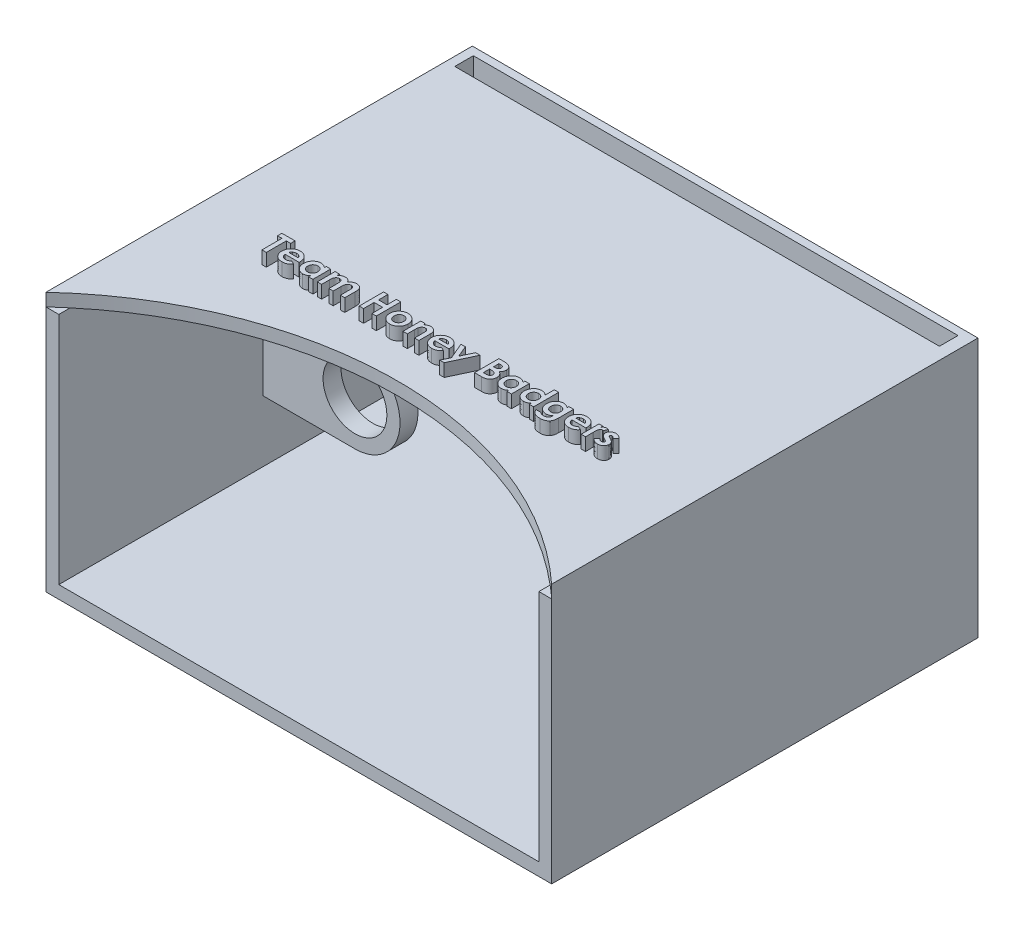
from build123d import *

# Parameters (mm, degrees)
SKETCH1_W           = 394.926652775
SKETCH1_H           = 202.769674437
BOSS_EXTRUDE1_DEPTH = 333
SHELL5_T            = -10
BOSS_EXTRUDE2_DEPTH = 7
SKETCH19_R          = 24.92303726
CUT_EXTRUDE1_DEPTH  = 14
BOSS_EXTRUDE3_DEPTH = 7
SKETCH23_R          = 24.92303726
CUT_EXTRUDE2_DEPTH  = 14
SKETCH24_W          = 378.549978472
SKETCH24_H          = 14.5311901
CUT_EXTRUDE6_DEPTH  = 30
SKETCH25_W          = 25.994787148
SKETCH25_H          = 10.885886146
BOSS_EXTRUDE5_DEPTH = 14
SKETCH27_W          = 29.478735589
SKETCH27_H          = 14.140745891
BOSS_EXTRUDE7_DEPTH = 14
EXTRUDE_THIN2_REACH = 553.377
SKETCH33_W          = 10
SKETCH33_H          = 122.071459974
CUT_EXTRUDE8_DEPTH  = 49
SKETCH35_W          = 10
SKETCH35_H          = 10.654236951
CUT_EXTRUDE11_DEPTH = 182.769674437
BOSS_EXTRUDE9_DEPTH = 10
CUT_EXTRUDE12_DEPTH = 10


with BuildPart() as part:
    # Sketch1 → Boss-Extrude1 (new body)
    with BuildSketch(Plane.XY):
        with Locations((197.463326388, 101.384837219)):
            Rectangle(SKETCH1_W, SKETCH1_H)
    extrude(amount=BOSS_EXTRUDE1_DEPTH)

    # Shell5
    shell5_openings = [part.faces().sort_by_distance(p)[0] for p in [
        (197.463326387, 101.384837219, 333),
    ]]
    offset(amount=SHELL5_T, openings=shell5_openings, kind=Kind.INTERSECTION)

    # Sketch18 → Boss-Extrude2 (add, symmetric)
    with BuildSketch(Plane.XY.offset(166.5)):
        with BuildLine():
            Line((10, 128.355944405), (81.814439739, 128.355944405))
            ThreePointArc((81.814439739, 128.355944405), (117.012291579, 93.158092565), (81.814439739, 57.960240724))
            Line((81.814439739, 57.960240724), (10, 57.960240724))
            Line((10, 57.960240724), (10, 128.355944405))
        make_face()
    extrude(amount=BOSS_EXTRUDE2_DEPTH, both=True)

    # Sketch19 → Cut-Extrude1 (cut)
    with BuildSketch(Plane.XY.offset(173.5)):
        with Locations((81.814439739, 93.158092565)):
            Circle(SKETCH19_R)
    extrude(amount=-CUT_EXTRUDE1_DEPTH, mode=Mode.SUBTRACT)

    # Sketch22 → Boss-Extrude3 (add, symmetric)
    with BuildSketch(Plane.XY.offset(166.5)):
        with BuildLine():
            Line((384.926652775, 128.355944405), (291.108955259, 128.355944405))
            ThreePointArc((291.108955259, 128.355944405), (256.621992249, 93.868981396), (291.108955259, 59.382018386))
            Line((291.108955259, 59.382018386), (384.926652775, 59.382018386))
            Line((384.926652775, 59.382018386), (384.926652775, 128.355944405))
        make_face()
    extrude(amount=BOSS_EXTRUDE3_DEPTH, both=True)

    # Sketch23 → Cut-Extrude2 (cut)
    with BuildSketch(Plane.XY.offset(173.5)):
        with Locations((291.108955259, 93.868981396)):
            Circle(SKETCH23_R)
    extrude(amount=-CUT_EXTRUDE2_DEPTH, mode=Mode.SUBTRACT)

    # Sketch24 → Cut-Extrude6 (cut)
    with BuildSketch(Plane(origin=(0, 202.769674437, 0), x_dir=(1, 0, 0), z_dir=(0, 1, 0))):
        with Locations((196.17510715, -13.388641901)):
            Rectangle(SKETCH24_W, SKETCH24_H)
    extrude(amount=-CUT_EXTRUDE6_DEPTH, mode=Mode.SUBTRACT)

    # Sketch25 → Boss-Extrude5 (add)
    with BuildSketch(Plane(origin=(0, 10, 0), x_dir=(1, 0, 0), z_dir=(0, 1, 0))):
        with Locations((19.897511488, -26.097180024)):
            Rectangle(SKETCH25_W, SKETCH25_H)
    extrude(amount=BOSS_EXTRUDE5_DEPTH)

    # Sketch27 → Boss-Extrude7 (add)
    with BuildSketch(Plane(origin=(0, 10, 0), x_dir=(1, 0, 0), z_dir=(0, 1, 0))):
        with Locations((370.710728592, -27.724609897)):
            Rectangle(SKETCH27_W, SKETCH27_H)
    extrude(amount=BOSS_EXTRUDE7_DEPTH)

    # Sketch33 → Extrude-Thin2 (add, up to next)
    with BuildSketch(Plane.XZ.offset(-192.769674437), mode=Mode.PRIVATE) as extrude_thin2_sk1:
        with Locations((202.463326387, 71.035729987)):
            Rectangle(SKETCH33_W, SKETCH33_H)
    extrude_thin2_tool1 = extrude(extrude_thin2_sk1.sketch, amount=EXTRUDE_THIN2_REACH, mode=Mode.PRIVATE) - part.part
    add(extrude_thin2_tool1.solids().sort_by_distance((202.463326, 192.769674, 71.03573))[0])

    # Sketch34 → Cut-Extrude8 (cut)
    with BuildSketch(Plane.ZY.offset(-197.463326387)):
        Polygon((132.071459974, 58.157894262), (39.515170412, 10), (132.071459974, 10), align=None)
    extrude(amount=-CUT_EXTRUDE8_DEPTH, mode=Mode.SUBTRACT)

    # Sketch35 → Cut-Extrude11 (cut)
    with BuildSketch(Plane(origin=(0, 192.769674437, 0), x_dir=(1, 0, 0), z_dir=(0, 1, 0))):
        with Locations((202.463326387, -15.327118476)):
            Rectangle(SKETCH35_W, SKETCH35_H)
    extrude(amount=-CUT_EXTRUDE11_DEPTH, mode=Mode.SUBTRACT)

    # Sketch37 → Boss-Extrude9 (add)
    # profile 1 of 16: a face of its own
    with BuildSketch(Plane(origin=(0, 202.769674437, 0), x_dir=(1, 0, 0), z_dir=(0, 1, 0))):
        Polygon((62.264756133, -211.000726081), (72.52244844, -211.000726081), (72.52244844, -214.41995685), (69.103217671, -214.41995685), (69.103217671, -230.050726081), (65.683986902, -230.050726081), (65.683986902, -214.41995685), (62.264756133, -214.41995685), align=None)
    # profile 2 of 16: a face of its own
    with BuildSketch(Plane(origin=(0, 202.769674437, 0), x_dir=(1, 0, 0), z_dir=(0, 1, 0))):
        with BuildLine():
            Line((88.630230892, -223.94495685), (77.651294594, -223.94495685))
            add(Edge.make_bspline(
                [(77.651294594, -223.94495685), (77.673679759, -224.072525862), (77.717668373, -224.323209033), (77.813191213, -224.687348093), (77.935092684, -225.030506596), (78.081183919, -225.353143262), (78.249001823, -225.656963744), (78.444747504, -225.940543006), (78.665938107, -226.203630571), (78.911294767, -226.445083033), (79.176727833, -226.661429672), (79.460950055, -226.850963004), (79.76425473, -227.006368742), (80.083164586, -227.137359653), (80.420062612, -227.241117725), (80.775444638, -227.312677694), (81.148368599, -227.35494843), (81.402415794, -227.361062408), (81.532274162, -227.36418762)],
                knots=[0, 0, 0, 0, 1.091296461, 2.144483647, 3.168565212, 4.157007626, 5.126487748, 6.090021542, 7.05641414, 8.019231907, 8.98705074, 9.938580405, 10.892824166, 11.854447369, 12.841318655, 13.858982407, 14.905600794, 16, 16, 16, 16], degree=3))
            add(Edge.make_bspline(
                [(81.532274162, -227.36418762), (81.689022026, -227.360049325), (81.997704733, -227.351899803), (82.449927196, -227.27962565), (82.887292193, -227.170458719), (83.305660708, -227.008118328), (83.709878885, -226.80603308), (84.093292051, -226.554259727), (84.462536786, -226.260155907), (84.687819588, -226.033460796), (84.802676806, -225.917883533)],
                knots=[0, 0, 0, 0, 1.021034703, 2.010718019, 2.977989445, 3.954245119, 4.929443971, 5.918328161, 6.938689359, 8, 8, 8, 8], degree=3))
            Line((84.802676806, -225.917883533), (87.664756133, -227.280233293))
            add(Edge.make_bspline(
                [(87.664756133, -227.280233293), (87.574645236, -227.404752723), (87.396093807, -227.651483394), (87.104614591, -227.998697172), (86.800437469, -228.322661712), (86.483335586, -228.621246251), (86.152906778, -228.89359994), (85.810070217, -229.14304054), (85.449815487, -229.362870671), (85.079345818, -229.563725582), (84.691002914, -229.735917565), (84.285861493, -229.88275681), (83.865637555, -230.015498238), (83.425024581, -230.116639935), (82.967691551, -230.196702877), (82.492544433, -230.253558172), (81.999645852, -230.288674964), (81.664625557, -230.292838017), (81.494113104, -230.29495685)],
                knots=[0, 0, 0, 0, 1.028154879, 2.037251081, 3.030720504, 4.000128189, 4.949298328, 5.894184978, 6.834267904, 7.770992897, 8.712077017, 9.673380525, 10.653304757, 11.658697181, 12.695551717, 13.758623199, 14.859225354, 16, 16, 16, 16], degree=3))
            add(Edge.make_bspline(
                [(81.494113104, -230.29495685), (81.231782494, -230.289608718), (80.718023114, -230.27913471), (79.966557147, -230.181920925), (79.252872906, -230.020729991), (78.574955194, -229.801615672), (77.935734424, -229.512316128), (77.334894244, -229.158478787), (76.7664314, -228.74688742), (76.247715608, -228.268903818), (75.775150217, -227.748647084), (75.36007816, -227.189926878), (75.012751773, -226.596646767), (74.727520359, -225.972733204), (74.505828595, -225.316589213), (74.346001693, -224.627928468), (74.248025887, -223.907079884), (74.237444013, -223.416101531), (74.232063825, -223.166471274)],
                knots=[0, 0, 0, 0, 1.103565453, 2.161269334, 3.182010356, 4.179077853, 5.15417608, 6.128274628, 7.109042802, 8.101804412, 9.090965879, 10.063106201, 11.02526161, 11.978650795, 12.945248442, 13.93468508, 14.949922959, 16, 16, 16, 16], degree=3))
            add(Edge.make_bspline(
                [(74.232063825, -223.166471274), (74.237496965, -222.910497591), (74.248186425, -222.406880865), (74.345158122, -221.669387558), (74.506270462, -220.965719193), (74.728610723, -220.294906744), (75.009515141, -219.654852198), (75.36126066, -219.051155264), (75.774944239, -218.481714199), (76.245807223, -217.949192905), (76.766720455, -217.468534258), (77.32023998, -217.040171349), (77.912585155, -216.683230939), (78.537056047, -216.394823309), (79.189658315, -216.160499389), (79.877935129, -216.004576391), (80.59664975, -215.899883431), (81.087947239, -215.890241863), (81.337652767, -215.885341466)],
                knots=[0, 0, 0, 0, 1.079208495, 2.12329425, 3.130605359, 4.119693003, 5.099659317, 6.073216462, 7.060498243, 8.06384408, 9.066070512, 10.045757761, 11.010926815, 11.975797609, 12.942977511, 13.929384301, 14.947594487, 16, 16, 16, 16], degree=3))
            add(Edge.make_bspline(
                [(81.337652767, -215.885341466), (81.601240119, -215.89077257), (82.118766719, -215.901435983), (82.875466415, -215.997860415), (83.593889433, -216.160034272), (84.27709666, -216.37725395), (84.916363257, -216.673861505), (85.525735852, -217.01899147), (86.090598233, -217.439479697), (86.61697123, -217.915124201), (87.092130438, -218.442835294), (87.507472234, -219.016091168), (87.860876982, -219.629297181), (88.147315038, -220.284940016), (88.368779165, -220.981051366), (88.528754017, -221.716727196), (88.625982501, -222.494765663), (88.63636747, -223.027533193), (88.64167921, -223.300034975)],
                knots=[0, 0, 0, 0, 1.080001299, 2.120471247, 3.119684163, 4.095710327, 5.052285597, 6.002875087, 6.961153713, 7.931888285, 8.906493152, 9.865905668, 10.82813294, 11.801621613, 12.7925306, 13.817193356, 14.883530496, 16, 16, 16, 16], degree=3))
            Line((88.64167921, -223.300034975), (88.630230892, -223.94495685))
        make_face()
        with BuildLine():
            add(Edge.make_bspline(
                [(85.22244844, -221.258418389), (85.157925465, -221.084297014), (85.02963698, -220.738098362), (84.739838634, -220.260428696), (84.355285499, -219.846747365), (83.908022617, -219.480512002), (83.396996767, -219.183252505), (82.838311271, -218.968026975), (82.239027805, -218.838975047), (81.826753073, -218.823839523), (81.616228488, -218.816110697)],
                knots=[0, 0, 0, 0, 0.954238005, 1.897273737, 2.851915805, 3.847685534, 4.862635127, 5.880135777, 6.917509367, 8, 8, 8, 8], degree=3))
            add(Edge.make_bspline(
                [(81.616228488, -218.816110697), (81.386301365, -218.823535176), (80.936841716, -218.838048486), (80.288526772, -218.992402869), (79.676987509, -219.222772176), (79.316458619, -219.460287822), (79.135759738, -219.57933185)],
                knots=[0, 0, 0, 0, 1.044195649, 2.041185066, 3.018232172, 4, 4, 4, 4], degree=3))
            add(Edge.make_bspline(
                [(79.135759738, -219.57933185), (79.023017133, -219.66999839), (78.782655661, -219.863294817), (78.470497526, -220.248902838), (78.163019164, -220.715787588), (77.988200764, -221.07041954), (77.895525363, -221.258418389)],
                knots=[0, 0, 0, 0, 0.82159062, 1.751589201, 2.808063854, 4, 4, 4, 4], degree=3))
            Line((77.895525363, -221.258418389), (85.22244844, -221.258418389))
        make_face(mode=Mode.SUBTRACT)
    # profile 3 of 16: a face of its own
    with BuildSketch(Plane(origin=(0, 202.769674437, 0), x_dir=(1, 0, 0), z_dir=(0, 1, 0))):
        with BuildLine():
            Line((102.074371517, -216.129572235), (105.493602287, -216.129572235))
            Line((105.493602287, -216.129572235), (105.493602287, -230.050726081))
            Line((105.493602287, -230.050726081), (102.074371517, -230.050726081))
            Line((102.074371517, -230.050726081), (102.074371517, -228.531915985))
            add(Edge.make_bspline(
                [(102.074371517, -228.531915985), (101.904949892, -228.679755338), (101.576135976, -228.966682327), (101.058031642, -229.338977391), (100.538413347, -229.646072703), (100.014784311, -229.890657371), (99.479096576, -230.071257974), (98.927493404, -230.20201703), (98.352031123, -230.279128844), (97.960839792, -230.289625891), (97.762171998, -230.29495685)],
                knots=[0, 0, 0, 0, 1.129196829, 2.191548051, 3.199897424, 4.157751732, 5.089409408, 6.034969131, 7.002052659, 8, 8, 8, 8], degree=3))
            add(Edge.make_bspline(
                [(97.762171998, -230.29495685), (97.539158568, -230.289939746), (97.09847139, -230.280025663), (96.451811881, -230.175663942), (95.827397836, -230.015915067), (95.225736106, -229.789850441), (94.64792136, -229.496915006), (94.089531562, -229.144751854), (93.560139215, -228.720997954), (93.055337309, -228.243988058), (92.593143712, -227.719273777), (92.189089707, -227.154138075), (91.848502209, -226.556596154), (91.569477097, -225.928629141), (91.349987814, -225.270697927), (91.193523363, -224.580715755), (91.101209156, -223.858436198), (91.089783259, -223.366447651), (91.083986902, -223.116861899)],
                knots=[0, 0, 0, 0, 0.980476535, 1.937477201, 2.874147792, 3.812856188, 4.758993464, 5.720109578, 6.712210464, 7.737600662, 8.772720504, 9.783789959, 10.789002326, 11.793715968, 12.802552247, 13.835794126, 14.902098527, 16, 16, 16, 16], degree=3))
            add(Edge.make_bspline(
                [(91.083986902, -223.116861899), (91.0900702, -222.858415524), (91.102003268, -222.351444163), (91.189292943, -221.607487796), (91.342870037, -220.900397573), (91.552283443, -220.229194073), (91.821657427, -219.593761335), (92.149736942, -218.993058319), (92.540985201, -218.428655166), (92.991829461, -217.910158415), (93.478630529, -217.434931097), (93.999421613, -217.021208031), (94.546058679, -216.669731036), (95.119122626, -216.382789411), (95.718531615, -216.161055444), (96.341919191, -215.998949809), (96.992052754, -215.901680734), (97.434929007, -215.89083312), (97.659137142, -215.885341466)],
                knots=[0, 0, 0, 0, 1.136281865, 2.228943489, 3.287578264, 4.313574083, 5.316051562, 6.317280042, 7.318008486, 8.329309503, 9.333984563, 10.305318864, 11.248632312, 12.186624717, 13.117503092, 14.05354244, 15.014596925, 16, 16, 16, 16], degree=3))
            add(Edge.make_bspline(
                [(97.659137142, -215.885341466), (97.866826524, -215.889656256), (98.277768948, -215.898193671), (98.881795103, -215.990893658), (99.467613355, -216.131095806), (100.032028036, -216.33085863), (100.579668662, -216.583099834), (101.10111547, -216.899176866), (101.607775579, -217.265805147), (101.916917908, -217.552149601), (102.074371517, -217.697991706)],
                knots=[0, 0, 0, 0, 1.017011718, 2.012299608, 2.98747302, 3.965332399, 4.941441765, 5.936729654, 6.94912688, 8, 8, 8, 8], degree=3))
            Line((102.074371517, -217.697991706), (102.074371517, -216.129572235))
        make_face()
        with BuildLine():
            add(Edge.make_bspline(
                [(98.376565027, -219.060341466), (98.24031876, -219.064521972), (97.973284973, -219.07271549), (97.580575245, -219.122000074), (97.205262554, -219.208841708), (96.850023598, -219.337131574), (96.509564015, -219.493407321), (96.189053733, -219.689140124), (95.885847488, -219.920492137), (95.601728464, -220.181862331), (95.342712113, -220.469155963), (95.1194249, -220.782655562), (94.929666843, -221.113914093), (94.769180844, -221.46392754), (94.65430928, -221.836837642), (94.563331048, -222.227789772), (94.516119236, -222.639977811), (94.507561223, -222.920871202), (94.503217671, -223.063436418)],
                knots=[0, 0, 0, 0, 1.04836806, 2.054732945, 3.03993516, 4.00574415, 4.955904794, 5.917688631, 6.888591924, 7.88601754, 8.884115178, 9.859153345, 10.841239365, 11.818093293, 12.814750328, 13.83810466, 14.90274714, 16, 16, 16, 16], degree=3))
            add(Edge.make_bspline(
                [(94.503217671, -223.063436418), (94.507494874, -223.207294783), (94.515923053, -223.490766024), (94.564094417, -223.906431016), (94.651798876, -224.303094039), (94.779756375, -224.677548341), (94.936022161, -225.034846551), (95.126232765, -225.373339703), (95.359873177, -225.687042815), (95.619116585, -225.983379156), (95.909064266, -226.247996008), (96.213986175, -226.482951477), (96.538047306, -226.679538568), (96.877731824, -226.838421498), (97.231896335, -226.967897731), (97.604980989, -227.053647943), (97.993330952, -227.108466431), (98.258079376, -227.116100263), (98.39182945, -227.11995685)],
                knots=[0, 0, 0, 0, 1.099136573, 2.165835871, 3.191374663, 4.196217796, 5.183857741, 6.167377911, 7.154730987, 8.166690795, 9.170734848, 10.148332609, 11.103258353, 12.059567475, 13.009337315, 13.978056681, 14.978520572, 16, 16, 16, 16], degree=3))
            add(Edge.make_bspline(
                [(98.39182945, -227.11995685), (98.530613463, -227.115752908), (98.802705574, -227.107510895), (99.201822162, -227.058676086), (99.582176649, -226.971516039), (99.942186557, -226.842491685), (100.287350693, -226.687337687), (100.614554262, -226.495429654), (100.920246612, -226.26460853), (101.205975934, -226.000875542), (101.467791778, -225.711235985), (101.694166876, -225.393625337), (101.891347868, -225.058201659), (102.046421647, -224.697034312), (102.169571974, -224.316442039), (102.257929493, -223.914062802), (102.30599086, -223.48946279), (102.314345327, -223.199656735), (102.318602287, -223.0519881)],
                knots=[0, 0, 0, 0, 1.050008698, 2.058587853, 3.036635738, 3.995319155, 4.947022481, 5.895997462, 6.858296291, 7.838991643, 8.833936038, 9.806048392, 10.784806122, 11.771666913, 12.772873988, 13.80724452, 14.882696879, 16, 16, 16, 16], degree=3))
            add(Edge.make_bspline(
                [(102.318602287, -223.0519881), (102.314398224, -222.906859296), (102.306186468, -222.623380582), (102.257722217, -222.207646018), (102.16873741, -221.813167672), (102.04812172, -221.439220443), (101.890289131, -221.086659357), (101.692958946, -220.759393476), (101.469067053, -220.446084263), (101.20435253, -220.164269475), (100.920171068, -219.902446115), (100.609983016, -219.678605191), (100.283560982, -219.48569287), (99.938899424, -219.327304416), (99.572806929, -219.211199674), (99.191802441, -219.12130402), (98.789941501, -219.07274507), (98.516605797, -219.064543471), (98.376565027, -219.060341466)],
                knots=[0, 0, 0, 0, 1.106611376, 2.161533483, 3.185006901, 4.184773755, 5.152708835, 6.122342771, 7.094156588, 8.082475533, 9.064254463, 10.03606828, 10.992420271, 11.951521816, 12.920622147, 13.915721683, 14.932141191, 16, 16, 16, 16], degree=3))
        make_face(mode=Mode.SUBTRACT)
    # profile 4 of 16: a face of its own
    with BuildSketch(Plane(origin=(0, 202.769674437, 0), x_dir=(1, 0, 0), z_dir=(0, 1, 0))):
        with BuildLine():
            Line((108.912833056, -216.129572235), (112.332063825, -216.129572235))
            Line((112.332063825, -216.129572235), (112.332063825, -217.79339435))
            add(Edge.make_bspline(
                [(112.332063825, -217.79339435), (112.484149472, -217.639896227), (112.783593612, -217.337671038), (113.279831128, -216.949133388), (113.797457106, -216.616885696), (114.34274435, -216.347910278), (114.914359113, -216.142528121), (115.509592237, -215.992027104), (116.131501087, -215.903236219), (116.554936958, -215.891372504), (116.770194835, -215.885341466)],
                knots=[0, 0, 0, 0, 1.041528618, 2.050684245, 3.032913108, 4.004406485, 4.976926473, 5.95771665, 6.961784757, 8, 8, 8, 8], degree=3))
            add(Edge.make_bspline(
                [(116.770194835, -215.885341466), (116.985736927, -215.892121225), (117.410024563, -215.90546696), (118.029057273, -216.027592947), (118.615491861, -216.226006411), (119.162876169, -216.508820423), (119.67516637, -216.858081028), (120.12966767, -217.291832127), (120.538773459, -217.792807033), (120.756842593, -218.171549447), (120.868692431, -218.365810216)],
                knots=[0, 0, 0, 0, 1.023965777, 2.015643508, 2.987309376, 3.958410333, 4.93654923, 5.924956801, 6.93568961, 8, 8, 8, 8], degree=3))
            add(Edge.make_bspline(
                [(120.868692431, -218.365810216), (121.012769475, -218.171020984), (121.295552283, -217.788704383), (121.796810565, -217.289546715), (122.338820319, -216.858035798), (122.932068188, -216.506241936), (123.560799561, -216.226971749), (124.222263191, -216.028330163), (124.910462026, -215.905671066), (125.3788191, -215.892174296), (125.615928008, -215.885341466)],
                knots=[0, 0, 0, 0, 1.041189987, 2.043563759, 3.033412161, 4.015238574, 5.00275396, 5.986226558, 6.980513695, 8, 8, 8, 8], degree=3))
            add(Edge.make_bspline(
                [(125.615928008, -215.885341466), (125.860833353, -215.892436307), (126.337763747, -215.906252849), (127.028904374, -216.042183443), (127.676241206, -216.252216605), (128.26546828, -216.55786626), (128.798266129, -216.919920383), (129.25227417, -217.347702436), (129.629059361, -217.826285278), (129.874394837, -218.273164879), (130.032997632, -218.668257619), (130.128763408, -219.012062332), (130.218334038, -219.395963778), (130.282681573, -219.825122132), (130.342747157, -220.295503638), (130.377617591, -220.81023555), (130.401319386, -221.367583857), (130.403836816, -221.753210116), (130.405140748, -221.952949639)],
                knots=[0, 0, 0, 0, 1.321991808, 2.574456155, 3.791773975, 4.987670122, 6.148905103, 7.262530793, 8.344737981, 9.427709016, 10.004683293, 10.642050061, 11.354108788, 12.133887687, 12.985666279, 13.916212488, 14.92067847, 16, 16, 16, 16], degree=3))
            Line((130.405140748, -221.952949639), (130.405140748, -230.050726081))
            Line((130.405140748, -230.050726081), (126.985909979, -230.050726081))
            Line((126.985909979, -230.050726081), (126.985909979, -223.059620312))
            add(Edge.make_bspline(
                [(126.985909979, -223.059620312), (126.983064117, -222.872621228), (126.977601742, -222.513693384), (126.954379082, -221.998879918), (126.902396834, -221.53198853), (126.841466978, -221.110433079), (126.75427518, -220.736448701), (126.647960615, -220.409133858), (126.524636364, -220.128017393), (126.375726049, -219.893128605), (126.20894632, -219.695315143), (126.023427933, -219.525749832), (125.821105198, -219.381077068), (125.600143762, -219.257764096), (125.354755003, -219.174365092), (125.093222859, -219.108927257), (124.81350076, -219.064363624), (124.620100964, -219.06170687), (124.520705652, -219.060341466)],
                knots=[0, 0, 0, 0, 1.669139205, 3.203761885, 4.596586177, 5.860166715, 7.002923539, 8.018877315, 8.928339525, 9.734594377, 10.491888885, 11.231098709, 11.971440889, 12.708030942, 13.480072485, 14.275788656, 15.113863979, 16, 16, 16, 16], degree=3))
            add(Edge.make_bspline(
                [(124.520705652, -219.060341466), (124.367538883, -219.065636838), (124.066979578, -219.076027952), (123.629003412, -219.175326684), (123.216864613, -219.337669483), (122.832107221, -219.558522483), (122.483010363, -219.834363706), (122.177638982, -220.161537698), (121.925444809, -220.541929991), (121.750869854, -220.894857736), (121.641782436, -221.213975334), (121.564831178, -221.487273929), (121.50485073, -221.796334215), (121.457903602, -222.138026127), (121.412863313, -222.514281283), (121.390766801, -222.924623895), (121.368155325, -223.368483898), (121.368449679, -223.675248263), (121.368602287, -223.834289783)],
                knots=[0, 0, 0, 0, 1.129913425, 2.217230253, 3.297175357, 4.391411011, 5.481605898, 6.571841268, 7.681894157, 8.841607612, 9.468549532, 10.170608623, 10.93710061, 11.791434153, 12.717934886, 13.734733707, 14.825576123, 16, 16, 16, 16], degree=3))
            Line((121.368602287, -223.834289783), (121.368602287, -230.050726081))
            Line((121.368602287, -230.050726081), (117.949371517, -230.050726081))
            Line((117.949371517, -230.050726081), (117.949371517, -223.376357091))
            add(Edge.make_bspline(
                [(117.949371517, -223.376357091), (117.949084438, -223.227509874), (117.94853219, -222.941176045), (117.931932713, -222.527704515), (117.909951762, -222.145920259), (117.879137029, -221.794758413), (117.843598302, -221.474655736), (117.79230773, -221.187363412), (117.738422251, -220.931298374), (117.646034869, -220.640416131), (117.515849169, -220.318069926), (117.321349829, -219.976239724), (117.086173562, -219.69003749), (116.816264434, -219.457235958), (116.511255539, -219.279859872), (116.178873701, -219.147914109), (115.812772294, -219.076693836), (115.560772563, -219.065907284), (115.43074171, -219.060341466)],
                knots=[0, 0, 0, 0, 1.256487322, 2.417074606, 3.49288742, 4.484586665, 5.393016842, 6.210437544, 6.947749329, 7.599905853, 8.784490193, 9.876739139, 10.906602197, 11.896672079, 12.869113195, 13.872201355, 14.902064413, 16, 16, 16, 16], degree=3))
            add(Edge.make_bspline(
                [(115.43074171, -219.060341466), (115.283818034, -219.06532831), (114.992834467, -219.075204797), (114.568972449, -219.181286337), (114.163721051, -219.340650451), (113.785995391, -219.567663373), (113.442157699, -219.849995982), (113.139843736, -220.186476162), (112.888974938, -220.576704795), (112.713625078, -220.939367552), (112.606128285, -221.266446693), (112.527107918, -221.546841744), (112.469359125, -221.862708233), (112.421176677, -222.210499541), (112.376403043, -222.590626197), (112.354215102, -223.004759848), (112.331625969, -223.452441464), (112.331914355, -223.761747386), (112.332063825, -223.922060216)],
                knots=[0, 0, 0, 0, 1.07893236, 2.136834559, 3.195274846, 4.273923004, 5.364443877, 6.458052972, 7.587287137, 8.767908, 9.410170275, 10.118584836, 10.909717261, 11.770069756, 12.702352573, 13.724628867, 14.820678298, 16, 16, 16, 16], degree=3))
            Line((112.332063825, -223.922060216), (112.332063825, -230.050726081))
            Line((112.332063825, -230.050726081), (108.912833056, -230.050726081))
            Line((108.912833056, -230.050726081), (108.912833056, -216.129572235))
        make_face()
    # profile 5 of 16: a face of its own
    with BuildSketch(Plane(origin=(0, 202.769674437, 0), x_dir=(1, 0, 0), z_dir=(0, 1, 0))):
        Polygon((141.639756133, -211.000726081), (145.058986902, -211.000726081), (145.058986902, -218.327649158), (151.653217671, -218.327649158), (151.653217671, -211.000726081), (155.07244844, -211.000726081), (155.07244844, -230.050726081), (151.653217671, -230.050726081), (151.653217671, -221.746879927), (145.058986902, -221.746879927), (145.058986902, -230.050726081), (141.639756133, -230.050726081), align=None)
    # profile 6 of 16: a face of its own
    with BuildSketch(Plane(origin=(0, 202.769674437, 0), x_dir=(1, 0, 0), z_dir=(0, 1, 0))):
        with BuildLine():
            add(Edge.make_bspline(
                [(165.612532575, -215.885341466), (165.774187205, -215.888218221), (166.094336621, -215.893915499), (166.571159182, -215.941340135), (167.039645786, -216.018715384), (167.50248923, -216.118902825), (167.955391581, -216.259280416), (168.400728257, -216.427641629), (168.842481134, -216.620939991), (169.269685992, -216.851032654), (169.685429069, -217.10058913), (170.079578248, -217.3758704), (170.448860393, -217.674714223), (170.800130636, -217.990191669), (171.117019218, -218.336037596), (171.419777019, -218.695587699), (171.692046773, -219.081723402), (171.944129345, -219.485035471), (172.168556645, -219.903191631), (172.363430481, -220.333283039), (172.532562649, -220.769363378), (172.664989747, -221.216744404), (172.774627178, -221.669526804), (172.84381619, -222.133259088), (172.893004779, -222.60317756), (172.898520379, -222.919565345), (172.901294594, -223.078700841)],
                knots=[0, 0, 0, 0, 1.022364134, 2.024744242, 3.027414945, 4.024939316, 5.017584196, 6.023349371, 7.035562955, 8.064994934, 9.090267829, 10.101425541, 11.102933353, 12.093946398, 13.084502048, 14.067315274, 15.065326281, 16.070028806, 17.074376865, 18.064572984, 19.055292013, 20.030201733, 21.013838017, 21.999348303, 22.993720005, 24, 24, 24, 24], degree=3))
            add(Edge.make_bspline(
                [(172.901294594, -223.078700841), (172.89836687, -223.239079582), (172.89254589, -223.557948877), (172.845595772, -224.032287514), (172.767924355, -224.498200514), (172.66735239, -224.958432652), (172.527500132, -225.407094818), (172.364097697, -225.850800468), (172.163514779, -226.283501729), (171.941755583, -226.709918963), (171.688052227, -227.117504014), (171.416018154, -227.507507865), (171.114528451, -227.869698882), (170.80017665, -228.215309618), (170.458052334, -228.532653063), (170.093616444, -228.826882029), (169.710023985, -229.101593597), (169.304516522, -229.350342515), (168.882287926, -229.568909319), (168.450459007, -229.76596513), (168.006504668, -229.930028162), (167.551343694, -230.063817047), (167.084700049, -230.167406432), (166.60760396, -230.237775933), (166.121082915, -230.28671711), (165.793284192, -230.292192588), (165.627796998, -230.29495685)],
                knots=[0, 0, 0, 0, 1.012026251, 2.012137606, 3.004615893, 3.992048833, 4.982446996, 5.968083444, 6.973977695, 7.990229942, 8.999482246, 10.001782172, 10.988562221, 11.971415814, 12.948383116, 13.930088534, 14.925840678, 15.924049238, 16.929462851, 17.924729459, 18.917889337, 19.913673841, 20.916777188, 21.931792057, 22.95587778, 24, 24, 24, 24], degree=3))
            add(Edge.make_bspline(
                [(165.627796998, -230.29495685), (165.385820975, -230.287854377), (164.908882549, -230.273855294), (164.206465007, -230.177965236), (163.531673622, -230.012913305), (162.883408828, -229.782834554), (162.260828514, -229.487997207), (161.669366063, -229.123091218), (161.103138036, -228.695300539), (160.571951929, -228.208240894), (160.085313495, -227.67389236), (159.660176274, -227.103478555), (159.299200369, -226.505549024), (159.002710549, -225.879421926), (158.773880868, -225.224238671), (158.608626796, -224.541958029), (158.512619501, -223.830662207), (158.498738817, -223.347387307), (158.49167921, -223.101597475)],
                knots=[0, 0, 0, 0, 1.029999031, 2.030143771, 3.011211297, 3.982305373, 4.953580601, 5.938004764, 6.935448627, 7.970290061, 9.001484052, 10.007591832, 10.993831261, 11.969999897, 12.951306496, 13.942897864, 14.953773953, 16, 16, 16, 16], degree=3))
            add(Edge.make_bspline(
                [(158.49167921, -223.101597475), (158.498985007, -222.839147815), (158.513344404, -222.323308263), (158.627364342, -221.567591563), (158.809441881, -220.844028638), (159.07080272, -220.154643523), (159.404668204, -219.49816474), (159.812242297, -218.875976874), (160.295539253, -218.287938994), (160.665647945, -217.932273525), (160.853848681, -217.751417187)],
                knots=[0, 0, 0, 0, 1.043912699, 2.05178951, 3.033892, 4.007821512, 4.978932272, 5.95884105, 6.962068106, 8, 8, 8, 8], degree=3))
            add(Edge.make_bspline(
                [(160.853848681, -217.751417187), (161.026541668, -217.601507625), (161.367229182, -217.305767094), (161.920734263, -216.930668713), (162.487461009, -216.606698149), (163.074201882, -216.34033409), (163.682592564, -216.139499887), (164.3095154, -215.993310556), (164.954840029, -215.903516785), (165.392187622, -215.891430694), (165.612532575, -215.885341466)],
                knots=[0, 0, 0, 0, 1.048115528, 2.067714963, 3.060638214, 4.039924844, 5.017819947, 5.994373833, 6.98952318, 8, 8, 8, 8], degree=3))
        make_face()
        with BuildLine():
            add(Edge.make_bspline(
                [(165.68885469, -219.060341466), (165.556471458, -219.064741446), (165.29587364, -219.073402854), (164.912266806, -219.11988632), (164.549447422, -219.215158173), (164.20020922, -219.336317897), (163.870730257, -219.498351956), (163.551987279, -219.687969146), (163.260554218, -219.925251726), (162.982327699, -220.185533358), (162.729760035, -220.474569124), (162.514548403, -220.789473375), (162.322252041, -221.118198535), (162.176443462, -221.47277964), (162.055772924, -221.84352496), (161.974104551, -222.236424613), (161.917269066, -222.647089693), (161.913049836, -222.928398089), (161.910909979, -223.071068629)],
                knots=[0, 0, 0, 0, 1.030650113, 2.02884584, 2.99876339, 3.944280128, 4.900564847, 5.851248946, 6.823638398, 7.81794922, 8.81432732, 9.802856497, 10.78262424, 11.771747962, 12.779760563, 13.812642396, 14.89064281, 16, 16, 16, 16], degree=3))
            add(Edge.make_bspline(
                [(161.910909979, -223.071068629), (161.913413903, -223.218770451), (161.918307341, -223.507425297), (161.968979916, -223.928900188), (162.052540663, -224.328877067), (162.171254298, -224.706738054), (162.320556738, -225.06519539), (162.503733518, -225.402237887), (162.722717864, -225.715839038), (162.970992962, -226.005612667), (163.24284359, -226.268643397), (163.540716256, -226.494366527), (163.852137173, -226.690489968), (164.18428317, -226.848007363), (164.532436823, -226.969623571), (164.897631654, -227.059165495), (165.281786764, -227.107406342), (165.543719838, -227.115715822), (165.677406373, -227.11995685)],
                knots=[0, 0, 0, 0, 1.141730614, 2.231293227, 3.276944405, 4.297399982, 5.28939179, 6.275415646, 7.257752684, 8.24146775, 9.222424823, 10.176631434, 11.126518621, 12.063689483, 13.012557477, 13.974037417, 14.965980454, 16, 16, 16, 16], degree=3))
            add(Edge.make_bspline(
                [(165.677406373, -227.11995685), (165.811159771, -227.11619525), (166.073394079, -227.108820329), (166.458000306, -227.05359382), (166.825060091, -226.966678179), (167.176187248, -226.844015262), (167.508542881, -226.683126292), (167.823399278, -226.48606457), (168.123526269, -226.257201834), (168.399025159, -225.989208214), (168.654049212, -225.698530885), (168.877690054, -225.383274256), (169.064572776, -225.046231672), (169.217850071, -224.689523812), (169.336796425, -224.313640964), (169.418973808, -223.917186022), (169.47583968, -223.501387627), (169.479963487, -223.216279779), (169.482063825, -223.071068629)],
                knots=[0, 0, 0, 0, 1.031504075, 2.022346795, 2.991027682, 3.937587355, 4.885570121, 5.833146507, 6.798790848, 7.791235734, 8.792807298, 9.778388351, 10.766749885, 11.760164525, 12.768777521, 13.802286646, 14.880660483, 16, 16, 16, 16], degree=3))
            add(Edge.make_bspline(
                [(169.482063825, -223.071068629), (169.479528048, -222.925908232), (169.474552032, -222.641056443), (169.423875845, -222.224695687), (169.34113514, -221.829522198), (169.220890361, -221.457223334), (169.072475354, -221.103551753), (168.889171963, -220.77031777), (168.669107656, -220.459162646), (168.419625623, -220.171629263), (168.143699784, -219.912289452), (167.850998906, -219.681021297), (167.53482982, -219.489744766), (167.201124048, -219.332064623), (166.848993758, -219.210752262), (166.478834275, -219.120702881), (166.089511174, -219.07314848), (165.823802633, -219.064655087), (165.68885469, -219.060341466)],
                knots=[0, 0, 0, 0, 1.123894411, 2.205445421, 3.243160173, 4.246488011, 5.231014757, 6.210004299, 7.185865357, 8.177612767, 9.153374344, 10.115157457, 11.061423229, 12.009021698, 12.96873347, 13.94135618, 14.954456845, 16, 16, 16, 16], degree=3))
        make_face(mode=Mode.SUBTRACT)
    # profile 7 of 16: a face of its own
    with BuildSketch(Plane(origin=(0, 202.769674437, 0), x_dir=(1, 0, 0), z_dir=(0, 1, 0))):
        with BuildLine():
            Line((175.832063825, -216.129572235), (179.251294594, -216.129572235))
            Line((179.251294594, -216.129572235), (179.251294594, -217.602589062))
            add(Edge.make_bspline(
                [(179.251294594, -217.602589062), (179.446360015, -217.450863161), (179.819167953, -217.160885468), (180.385900387, -216.791162432), (180.920825637, -216.488558974), (181.435867762, -216.258383298), (181.94071729, -216.092781797), (182.443550625, -215.973806998), (182.95185597, -215.897624163), (183.293560546, -215.889433501), (183.464275363, -215.885341466)],
                knots=[0, 0, 0, 0, 1.276643801, 2.439914479, 3.493451431, 4.44993799, 5.350072675, 6.235028322, 7.118224225, 8, 8, 8, 8], degree=3))
            add(Edge.make_bspline(
                [(183.464275363, -215.885341466), (183.637442573, -215.890017815), (183.977384348, -215.899197882), (184.477929879, -215.963405012), (184.956152523, -216.080346534), (185.417429501, -216.235613247), (185.857065801, -216.440556403), (186.280447236, -216.68389315), (186.678479722, -216.980293771), (186.92360575, -217.206018253), (187.047598681, -217.320197235)],
                knots=[0, 0, 0, 0, 1.048836932, 2.058954983, 3.049370783, 4.026390553, 5.001981509, 5.982488534, 6.97947532, 8, 8, 8, 8], degree=3))
            add(Edge.make_bspline(
                [(187.047598681, -217.320197235), (187.147045576, -217.426007763), (187.346667199, -217.638403226), (187.59786593, -218.001866263), (187.813422697, -218.398107499), (187.990041515, -218.831697709), (188.120555707, -219.305019186), (188.220962055, -219.812354885), (188.277301808, -220.356545512), (188.284257216, -220.730399338), (188.287833056, -220.922601081)],
                knots=[0, 0, 0, 0, 0.889584746, 1.785680191, 2.700364693, 3.65222533, 4.649950538, 5.707241244, 6.821271309, 8, 8, 8, 8], degree=3))
            Line((188.287833056, -220.922601081), (188.287833056, -230.050726081))
            Line((188.287833056, -230.050726081), (184.868602287, -230.050726081))
            Line((184.868602287, -230.050726081), (184.868602287, -224.006014543))
            add(Edge.make_bspline(
                [(184.868602287, -224.006014543), (184.867879195, -223.808846583), (184.866493524, -223.431010783), (184.855854634, -222.890270971), (184.835081325, -222.401912699), (184.816146995, -221.965046806), (184.778971379, -221.581224462), (184.745445806, -221.248015776), (184.694004066, -220.968443644), (184.627070017, -220.667721869), (184.510186681, -220.345744215), (184.328731001, -220.006487565), (184.098529026, -219.718281476), (183.828983123, -219.479105483), (183.520390983, -219.289895334), (183.176481495, -219.156774209), (182.799098423, -219.073809855), (182.536142333, -219.064945154), (182.399581854, -219.060341466)],
                knots=[0, 0, 0, 0, 1.49886392, 2.872294502, 4.110984203, 5.214877267, 6.195405875, 7.042225351, 7.75923308, 8.355011229, 9.382752534, 10.352059385, 11.267231453, 12.171456522, 13.078624015, 14.003401117, 14.963110155, 16, 16, 16, 16], degree=3))
            add(Edge.make_bspline(
                [(182.399581854, -219.060341466), (182.221979207, -219.069347744), (181.874553904, -219.086965773), (181.372072706, -219.219821794), (180.910552099, -219.445770776), (180.493763083, -219.758438734), (180.125675228, -220.144466072), (179.822508304, -220.604847955), (179.573849147, -221.128473094), (179.466922013, -221.510804497), (179.411571037, -221.70871887)],
                knots=[0, 0, 0, 0, 0.984188326, 1.925263693, 2.85911992, 3.81709677, 4.80007086, 5.801799564, 6.862098548, 8, 8, 8, 8], degree=3))
            add(Edge.make_bspline(
                [(179.411571037, -221.70871887), (179.39781412, -221.770875204), (179.36713343, -221.909496328), (179.341902444, -222.143681564), (179.30680431, -222.421519673), (179.293653902, -222.748038742), (179.270786789, -223.121693493), (179.262329439, -223.542978261), (179.253856956, -224.01106698), (179.252177011, -224.338009163), (179.251294594, -224.509740504)],
                knots=[0, 0, 0, 0, 0.543362196, 1.211806945, 2.009705693, 2.934833164, 4.000995085, 5.207458376, 6.533175157, 8, 8, 8, 8], degree=3))
            Line((179.251294594, -224.509740504), (179.251294594, -230.050726081))
            Line((179.251294594, -230.050726081), (175.832063825, -230.050726081))
            Line((175.832063825, -230.050726081), (175.832063825, -216.129572235))
        make_face()
    # profile 8 of 16: a face of its own
    with BuildSketch(Plane(origin=(0, 202.769674437, 0), x_dir=(1, 0, 0), z_dir=(0, 1, 0))):
        with BuildLine():
            Line((205.616769354, -223.94495685), (194.637833056, -223.94495685))
            add(Edge.make_bspline(
                [(194.637833056, -223.94495685), (194.66021822, -224.072525862), (194.704206835, -224.323209033), (194.799729675, -224.687348093), (194.921631145, -225.030506596), (195.067722381, -225.353143262), (195.235540284, -225.656963744), (195.431285966, -225.940543006), (195.652476569, -226.203630571), (195.897833228, -226.445083033), (196.163266295, -226.661429672), (196.447488517, -226.850963004), (196.750793191, -227.006368742), (197.069703047, -227.137359653), (197.406601073, -227.241117725), (197.761983099, -227.312677694), (198.134907061, -227.35494843), (198.388954256, -227.361062408), (198.518812623, -227.36418762)],
                knots=[0, 0, 0, 0, 1.091296461, 2.144483647, 3.168565212, 4.157007626, 5.126487748, 6.090021542, 7.05641414, 8.019231907, 8.98705074, 9.938580405, 10.892824166, 11.854447369, 12.841318655, 13.858982407, 14.905600794, 16, 16, 16, 16], degree=3))
            add(Edge.make_bspline(
                [(198.518812623, -227.36418762), (198.675560488, -227.360049325), (198.984243194, -227.351899803), (199.436465658, -227.27962565), (199.873830654, -227.170458719), (200.29219917, -227.008118328), (200.696417346, -226.80603308), (201.079830512, -226.554259727), (201.449075248, -226.260155907), (201.67435805, -226.033460796), (201.789215267, -225.917883533)],
                knots=[0, 0, 0, 0, 1.021034703, 2.010718019, 2.977989445, 3.954245119, 4.929443971, 5.918328161, 6.938689359, 8, 8, 8, 8], degree=3))
            Line((201.789215267, -225.917883533), (204.651294594, -227.280233293))
            add(Edge.make_bspline(
                [(204.651294594, -227.280233293), (204.561183697, -227.404752723), (204.382632268, -227.651483394), (204.091153052, -227.998697172), (203.78697593, -228.322661712), (203.469874047, -228.621246251), (203.139445239, -228.89359994), (202.796608678, -229.14304054), (202.436353949, -229.362870671), (202.065884279, -229.563725582), (201.677541375, -229.735917565), (201.272399955, -229.88275681), (200.852176017, -230.015498238), (200.411563043, -230.116639935), (199.954230012, -230.196702877), (199.479082895, -230.253558172), (198.986184313, -230.288674964), (198.651164019, -230.292838017), (198.480651565, -230.29495685)],
                knots=[0, 0, 0, 0, 1.028154879, 2.037251081, 3.030720504, 4.000128189, 4.949298328, 5.894184978, 6.834267904, 7.770992897, 8.712077017, 9.673380525, 10.653304757, 11.658697181, 12.695551717, 13.758623199, 14.859225354, 16, 16, 16, 16], degree=3))
            add(Edge.make_bspline(
                [(198.480651565, -230.29495685), (198.218320955, -230.289608718), (197.704561576, -230.27913471), (196.953095609, -230.181920925), (196.239411367, -230.020729991), (195.561493655, -229.801615672), (194.922272885, -229.512316128), (194.321432705, -229.158478787), (193.752969862, -228.74688742), (193.234254069, -228.268903818), (192.761688678, -227.748647084), (192.346616622, -227.189926878), (191.999290235, -226.596646767), (191.714058821, -225.972733204), (191.492367057, -225.316589213), (191.332540154, -224.627928468), (191.234564348, -223.907079884), (191.223982475, -223.416101531), (191.218602287, -223.166471274)],
                knots=[0, 0, 0, 0, 1.103565453, 2.161269334, 3.182010356, 4.179077853, 5.15417608, 6.128274628, 7.109042802, 8.101804412, 9.090965879, 10.063106201, 11.02526161, 11.978650795, 12.945248442, 13.93468508, 14.949922959, 16, 16, 16, 16], degree=3))
            add(Edge.make_bspline(
                [(191.218602287, -223.166471274), (191.224035427, -222.910497591), (191.234724886, -222.406880865), (191.331696583, -221.669387558), (191.492808923, -220.965719193), (191.715149184, -220.294906744), (191.996053603, -219.654852198), (192.347799122, -219.051155264), (192.761482701, -218.481714199), (193.232345684, -217.949192905), (193.753258917, -217.468534258), (194.306778441, -217.040171349), (194.899123617, -216.683230939), (195.523594509, -216.394823309), (196.176196776, -216.160499389), (196.86447359, -216.004576391), (197.583188212, -215.899883431), (198.074485701, -215.890241863), (198.324191229, -215.885341466)],
                knots=[0, 0, 0, 0, 1.079208495, 2.12329425, 3.130605359, 4.119693003, 5.099659317, 6.073216462, 7.060498243, 8.06384408, 9.066070512, 10.045757761, 11.010926815, 11.975797609, 12.942977511, 13.929384301, 14.947594487, 16, 16, 16, 16], degree=3))
            add(Edge.make_bspline(
                [(198.324191229, -215.885341466), (198.587778581, -215.89077257), (199.10530518, -215.901435983), (199.862004876, -215.997860415), (200.580427895, -216.160034272), (201.263635121, -216.37725395), (201.902901719, -216.673861505), (202.512274314, -217.01899147), (203.077136694, -217.439479697), (203.603509692, -217.915124201), (204.078668899, -218.442835294), (204.494010695, -219.016091168), (204.847415444, -219.629297181), (205.1338535, -220.284940016), (205.355317627, -220.981051366), (205.515292478, -221.716727196), (205.612520963, -222.494765663), (205.622905931, -223.027533193), (205.628217671, -223.300034975)],
                knots=[0, 0, 0, 0, 1.080001299, 2.120471247, 3.119684163, 4.095710327, 5.052285597, 6.002875087, 6.961153713, 7.931888285, 8.906493152, 9.865905668, 10.82813294, 11.801621613, 12.7925306, 13.817193356, 14.883530496, 16, 16, 16, 16], degree=3))
            Line((205.628217671, -223.300034975), (205.616769354, -223.94495685))
        make_face()
        with BuildLine():
            add(Edge.make_bspline(
                [(202.208986902, -221.258418389), (202.144463926, -221.084297014), (202.016175442, -220.738098362), (201.726377095, -220.260428696), (201.341823961, -219.846747365), (200.894561078, -219.480512002), (200.383535229, -219.183252505), (199.824849732, -218.968026975), (199.225566266, -218.838975047), (198.813291535, -218.823839523), (198.60276695, -218.816110697)],
                knots=[0, 0, 0, 0, 0.954238005, 1.897273737, 2.851915805, 3.847685534, 4.862635127, 5.880135777, 6.917509367, 8, 8, 8, 8], degree=3))
            add(Edge.make_bspline(
                [(198.60276695, -218.816110697), (198.372839827, -218.823535176), (197.923380178, -218.838048486), (197.275065234, -218.992402869), (196.66352597, -219.222772176), (196.30299708, -219.460287822), (196.1222982, -219.57933185)],
                knots=[0, 0, 0, 0, 1.044195649, 2.041185066, 3.018232172, 4, 4, 4, 4], degree=3))
            add(Edge.make_bspline(
                [(196.1222982, -219.57933185), (196.009555594, -219.66999839), (195.769194123, -219.863294817), (195.457035987, -220.248902838), (195.149557626, -220.715787588), (194.974739225, -221.07041954), (194.882063825, -221.258418389)],
                knots=[0, 0, 0, 0, 0.82159062, 1.751589201, 2.808063854, 4, 4, 4, 4], degree=3))
            Line((194.882063825, -221.258418389), (202.208986902, -221.258418389))
        make_face(mode=Mode.SUBTRACT)
    # profile 9 of 16: a face of its own
    with BuildSketch(Plane(origin=(0, 202.769674437, 0), x_dir=(1, 0, 0), z_dir=(0, 1, 0))):
        Polygon((207.20808546, -216.129572235), (210.631132335, -216.129572235), (214.431973681, -225.085972475), (218.637322238, -216.129572235), (222.113794594, -216.129572235), (213.165026565, -235.179572235), (209.68855421, -235.179572235), (212.630771758, -228.917342668), align=None)
    # profile 10 of 16: a face of its own
    with BuildSketch(Plane(origin=(0, 202.769674437, 0), x_dir=(1, 0, 0), z_dir=(0, 1, 0))):
        with BuildLine():
            Line((231.760909979, -230.050726081), (231.760909979, -211.000726081))
            Line((231.760909979, -211.000726081), (234.813794594, -211.000726081))
            add(Edge.make_bspline(
                [(234.813794594, -211.000726081), (235.027515606, -211.00070169), (235.441061712, -211.000654495), (236.037700818, -211.021606501), (236.591033201, -211.048710269), (237.099297943, -211.079033082), (237.563360145, -211.131285348), (237.982514126, -211.186353528), (238.357597358, -211.25276236), (238.589490939, -211.312333139), (238.698590267, -211.340359495)],
                knots=[0, 0, 0, 0, 1.311965854, 2.538629056, 3.664479157, 4.713267157, 5.663616078, 6.530575999, 7.308677837, 8, 8, 8, 8], degree=3))
            add(Edge.make_bspline(
                [(238.698590267, -211.340359495), (238.841848762, -211.379891169), (239.12296792, -211.457465004), (239.525620265, -211.614128718), (239.90759218, -211.788271542), (240.26841729, -211.986935936), (240.605879984, -212.212520333), (240.918697788, -212.46681504), (241.21361741, -212.739612679), (241.480166925, -213.038516042), (241.72108377, -213.354362814), (241.930397314, -213.687070233), (242.112263956, -214.031550988), (242.257804906, -214.392140138), (242.367467278, -214.767177074), (242.447673879, -215.155060329), (242.499658617, -215.557017262), (242.504570493, -215.830481701), (242.507063825, -215.969295793)],
                knots=[0, 0, 0, 0, 1.099996261, 2.158545794, 3.195537121, 4.207578794, 5.205712374, 6.197378256, 7.190519799, 8.17788031, 9.159561366, 10.129234751, 11.085776129, 12.040971148, 13.00380137, 13.975669004, 14.972423361, 16, 16, 16, 16], degree=3))
            add(Edge.make_bspline(
                [(242.507063825, -215.969295793), (242.500544503, -216.147635465), (242.487712018, -216.498675196), (242.405737233, -217.014289052), (242.252021738, -217.501618257), (242.050888752, -217.969644103), (241.777410774, -218.416620852), (241.430146632, -218.842335979), (241.014720869, -219.25989789), (240.696066376, -219.510198089), (240.530321037, -219.640389543)],
                knots=[0, 0, 0, 0, 0.986156485, 1.941127874, 2.875419072, 3.804401753, 4.751181392, 5.761612777, 6.835722519, 8, 8, 8, 8], degree=3))
            add(Edge.make_bspline(
                [(240.530321037, -219.640389543), (240.664633108, -219.708954691), (240.927981921, -219.843391976), (241.301859869, -220.064366741), (241.648030036, -220.29940143), (241.968044545, -220.543767048), (242.255190726, -220.807822611), (242.521325326, -221.076352872), (242.753318645, -221.3647435), (242.960774064, -221.662715703), (243.141090941, -221.974584153), (243.298127058, -222.299822175), (243.430769833, -222.639540852), (243.543095166, -222.992011293), (243.626867429, -223.358445829), (243.681488726, -223.738975513), (243.723310205, -224.132302546), (243.726563523, -224.400227099), (243.728217671, -224.536453245)],
                knots=[0, 0, 0, 0, 1.164658916, 2.283573913, 3.35186032, 4.395461096, 5.390182219, 6.362969632, 7.312859996, 8.245001507, 9.165155236, 10.092416118, 11.032087915, 11.979892451, 12.947605196, 13.931445124, 14.948243989, 16, 16, 16, 16], degree=3))
            add(Edge.make_bspline(
                [(243.728217671, -224.536453245), (243.717483353, -224.796637395), (243.696299221, -225.310109771), (243.541411177, -226.064005147), (243.272884526, -226.778766342), (242.912308605, -227.451552588), (242.468009695, -228.062887829), (241.957193359, -228.598412192), (241.385002346, -229.051721677), (240.857086977, -229.357670413), (240.400481758, -229.562990624), (240.022284186, -229.689932527), (239.616108009, -229.807531314), (239.174513057, -229.89011161), (238.705504844, -229.965698178), (238.204510508, -230.01236689), (237.672466401, -230.043993127), (237.30703551, -230.048436389), (237.118722479, -230.050726081)],
                knots=[0, 0, 0, 0, 1.284142165, 2.534249414, 3.780121997, 5.041676246, 6.291546858, 7.49970053, 8.684500223, 9.883330709, 10.50184324, 11.153274765, 11.851151195, 12.587658647, 13.369265475, 14.195992086, 15.070362669, 16, 16, 16, 16], degree=3))
            Line((237.118722479, -230.050726081), (231.760909979, -230.050726081))
        make_face()
        with BuildLine():
            Line((235.180140748, -214.41995685), (235.180140748, -218.571879927))
            Line((235.180140748, -218.571879927), (236.088373921, -218.571879927))
            add(Edge.make_bspline(
                [(236.088373921, -218.571879927), (236.211810969, -218.57080351), (236.450098721, -218.56872555), (236.794280102, -218.541962155), (237.114313203, -218.496302141), (237.408984208, -218.432594935), (237.681038084, -218.351696072), (237.928736872, -218.254357318), (238.150991486, -218.135593457), (238.409199943, -217.958689446), (238.682144902, -217.698367274), (238.922415279, -217.322277959), (239.063932927, -216.889776678), (239.079694176, -216.584743285), (239.087833056, -216.427228485)],
                knots=[0, 0, 0, 0, 1.065314748, 2.056525647, 2.977365736, 3.853934255, 4.656397591, 5.425096493, 6.14721249, 6.826394842, 8.123232004, 9.372140726, 10.643011755, 12, 12, 12, 12], degree=3))
            add(Edge.make_bspline(
                [(239.087833056, -216.427228485), (239.081320462, -216.279689704), (239.068728624, -215.9944294), (238.926238548, -215.593898528), (238.70492329, -215.238946202), (238.44362952, -214.996010363), (238.197570663, -214.830092346), (237.98687997, -214.720842398), (237.755631113, -214.623042961), (237.499347363, -214.548263128), (237.21949224, -214.492150975), (236.917425156, -214.450943318), (236.592624943, -214.422895633), (236.368284744, -214.420957457), (236.252466469, -214.41995685)],
                knots=[0, 0, 0, 0, 1.347982417, 2.606269829, 3.849316587, 5.153353503, 5.842674298, 6.568177932, 7.326619318, 8.142485038, 9.012069166, 9.942760135, 10.937925643, 12, 12, 12, 12], degree=3))
            Line((236.252466469, -214.41995685), (235.180140748, -214.41995685))
        make_face(mode=Mode.SUBTRACT)
        with BuildLine():
            Line((235.180140748, -221.746879927), (235.180140748, -226.631495312))
            Line((235.180140748, -226.631495312), (236.164696037, -226.631495312))
            add(Edge.make_bspline(
                [(236.164696037, -226.631495312), (236.359343871, -226.630383296), (236.733578621, -226.628245307), (237.269669237, -226.602413313), (237.75710963, -226.555855695), (238.194608267, -226.49773226), (238.582835259, -226.418984096), (238.920478306, -226.318865898), (239.212167745, -226.208718442), (239.456154592, -226.072673256), (239.655477869, -225.914350396), (239.835346228, -225.75254063), (239.98199968, -225.565877778), (240.098034628, -225.362374759), (240.19846267, -225.147086734), (240.259033774, -224.911606783), (240.305150486, -224.662913968), (240.307688412, -224.490898526), (240.308986902, -224.402889543)],
                knots=[0, 0, 0, 0, 1.753078804, 3.370512758, 4.83203934, 6.162291463, 7.344201807, 8.395507345, 9.331626367, 10.147333109, 10.898971645, 11.62040215, 12.321813352, 13.025280112, 13.727906689, 14.453419512, 15.208716525, 16, 16, 16, 16], degree=3))
            add(Edge.make_bspline(
                [(240.308986902, -224.402889543), (240.306123359, -224.302249886), (240.300545948, -224.106230908), (240.254995167, -223.819728252), (240.172214517, -223.552259013), (240.067948249, -223.296983642), (239.922856197, -223.063041886), (239.750419253, -222.842337909), (239.542071403, -222.642345428), (239.307772092, -222.45096815), (239.034485142, -222.283406975), (238.722082335, -222.138017976), (238.368866529, -222.016594438), (237.973743602, -221.919916937), (237.53844574, -221.837868079), (237.059795749, -221.788875853), (236.54177999, -221.752438181), (236.182579433, -221.748774778), (235.996787383, -221.746879927)],
                knots=[0, 0, 0, 0, 0.845221588, 1.646264278, 2.427170338, 3.19324141, 3.95557735, 4.731569926, 5.540061037, 6.376114724, 7.268642756, 8.224665384, 9.265483498, 10.400594375, 11.639216012, 12.983232105, 14.439614077, 16, 16, 16, 16], degree=3))
            Line((235.996787383, -221.746879927), (235.180140748, -221.746879927))
        make_face(mode=Mode.SUBTRACT)
    # profile 11 of 16: a face of its own
    with BuildSketch(Plane(origin=(0, 202.769674437, 0), x_dir=(1, 0, 0), z_dir=(0, 1, 0))):
        with BuildLine():
            Line((257.160909979, -216.129572235), (260.580140748, -216.129572235))
            Line((260.580140748, -216.129572235), (260.580140748, -230.050726081))
            Line((260.580140748, -230.050726081), (257.160909979, -230.050726081))
            Line((257.160909979, -230.050726081), (257.160909979, -228.531915985))
            add(Edge.make_bspline(
                [(257.160909979, -228.531915985), (256.991488354, -228.679755338), (256.662674438, -228.966682327), (256.144570103, -229.338977391), (255.624951809, -229.646072703), (255.101322773, -229.890657371), (254.565635037, -230.071257974), (254.014031865, -230.20201703), (253.438569584, -230.279128844), (253.047378254, -230.289625891), (252.84871046, -230.29495685)],
                knots=[0, 0, 0, 0, 1.129196829, 2.191548051, 3.199897424, 4.157751732, 5.089409408, 6.034969131, 7.002052659, 8, 8, 8, 8], degree=3))
            add(Edge.make_bspline(
                [(252.84871046, -230.29495685), (252.625697029, -230.289939746), (252.185009852, -230.280025663), (251.538350343, -230.175663942), (250.913936298, -230.015915067), (250.312274568, -229.789850441), (249.734459821, -229.496915006), (249.176070023, -229.144751854), (248.646677677, -228.720997954), (248.141875771, -228.243988058), (247.679682174, -227.719273777), (247.275628168, -227.154138075), (246.935040671, -226.556596154), (246.656015559, -225.928629141), (246.436526276, -225.270697927), (246.280061825, -224.580715755), (246.187747618, -223.858436198), (246.17632172, -223.366447651), (246.170525363, -223.116861899)],
                knots=[0, 0, 0, 0, 0.980476535, 1.937477201, 2.874147792, 3.812856188, 4.758993464, 5.720109578, 6.712210464, 7.737600662, 8.772720504, 9.783789959, 10.789002326, 11.793715968, 12.802552247, 13.835794126, 14.902098527, 16, 16, 16, 16], degree=3))
            add(Edge.make_bspline(
                [(246.170525363, -223.116861899), (246.176608662, -222.858415524), (246.188541729, -222.351444163), (246.275831404, -221.607487796), (246.429408498, -220.900397573), (246.638821905, -220.229194073), (246.908195889, -219.593761335), (247.236275404, -218.993058319), (247.627523662, -218.428655166), (248.078367922, -217.910158415), (248.56516899, -217.434931097), (249.085960074, -217.021208031), (249.632597141, -216.669731036), (250.205661088, -216.382789411), (250.805070077, -216.161055444), (251.428457653, -215.998949809), (252.078591216, -215.901680734), (252.521467468, -215.89083312), (252.745675604, -215.885341466)],
                knots=[0, 0, 0, 0, 1.136281865, 2.228943489, 3.287578264, 4.313574083, 5.316051562, 6.317280042, 7.318008486, 8.329309503, 9.333984563, 10.305318864, 11.248632312, 12.186624717, 13.117503092, 14.05354244, 15.014596925, 16, 16, 16, 16], degree=3))
            add(Edge.make_bspline(
                [(252.745675604, -215.885341466), (252.953364986, -215.889656256), (253.36430741, -215.898193671), (253.968333565, -215.990893658), (254.554151816, -216.131095806), (255.118566498, -216.33085863), (255.666207124, -216.583099834), (256.187653932, -216.899176866), (256.694314041, -217.265805147), (257.003456369, -217.552149601), (257.160909979, -217.697991706)],
                knots=[0, 0, 0, 0, 1.017011718, 2.012299608, 2.98747302, 3.965332399, 4.941441765, 5.936729654, 6.94912688, 8, 8, 8, 8], degree=3))
            Line((257.160909979, -217.697991706), (257.160909979, -216.129572235))
        make_face()
        with BuildLine():
            add(Edge.make_bspline(
                [(253.463103488, -219.060341466), (253.326857222, -219.064521972), (253.059823434, -219.07271549), (252.667113707, -219.122000074), (252.291801015, -219.208841708), (251.93656206, -219.337131574), (251.596102477, -219.493407321), (251.275592195, -219.689140124), (250.972385949, -219.920492137), (250.688266926, -220.181862331), (250.429250574, -220.469155963), (250.205963361, -220.782655562), (250.016205304, -221.113914093), (249.855719305, -221.46392754), (249.740847741, -221.836837642), (249.64986951, -222.227789772), (249.602657698, -222.639977811), (249.594099685, -222.920871202), (249.589756133, -223.063436418)],
                knots=[0, 0, 0, 0, 1.04836806, 2.054732945, 3.03993516, 4.00574415, 4.955904794, 5.917688631, 6.888591924, 7.88601754, 8.884115178, 9.859153345, 10.841239365, 11.818093293, 12.814750328, 13.83810466, 14.90274714, 16, 16, 16, 16], degree=3))
            add(Edge.make_bspline(
                [(249.589756133, -223.063436418), (249.594033336, -223.207294783), (249.602461514, -223.490766024), (249.650632879, -223.906431016), (249.738337338, -224.303094039), (249.866294836, -224.677548341), (250.022560623, -225.034846551), (250.212771227, -225.373339703), (250.446411639, -225.687042815), (250.705655047, -225.983379156), (250.995602727, -226.247996008), (251.300524637, -226.482951477), (251.624585768, -226.679538568), (251.964270285, -226.838421498), (252.318434797, -226.967897731), (252.691519451, -227.053647943), (253.079869413, -227.108466431), (253.344617837, -227.116100263), (253.478367912, -227.11995685)],
                knots=[0, 0, 0, 0, 1.099136573, 2.165835871, 3.191374663, 4.196217796, 5.183857741, 6.167377911, 7.154730987, 8.166690795, 9.170734848, 10.148332609, 11.103258353, 12.059567475, 13.009337315, 13.978056681, 14.978520572, 16, 16, 16, 16], degree=3))
            add(Edge.make_bspline(
                [(253.478367912, -227.11995685), (253.617151924, -227.115752908), (253.889244036, -227.107510895), (254.288360623, -227.058676086), (254.668715111, -226.971516039), (255.028725018, -226.842491685), (255.373889154, -226.687337687), (255.701092724, -226.495429654), (256.006785074, -226.26460853), (256.292514396, -226.000875542), (256.554330239, -225.711235985), (256.780705337, -225.393625337), (256.97788633, -225.058201659), (257.132960108, -224.697034312), (257.256110435, -224.316442039), (257.344467954, -223.914062802), (257.392529322, -223.48946279), (257.400883788, -223.199656735), (257.405140748, -223.0519881)],
                knots=[0, 0, 0, 0, 1.050008698, 2.058587853, 3.036635738, 3.995319155, 4.947022481, 5.895997462, 6.858296291, 7.838991643, 8.833936038, 9.806048392, 10.784806122, 11.771666913, 12.772873988, 13.80724452, 14.882696879, 16, 16, 16, 16], degree=3))
            add(Edge.make_bspline(
                [(257.405140748, -223.0519881), (257.400936685, -222.906859296), (257.392724929, -222.623380582), (257.344260679, -222.207646018), (257.255275871, -221.813167672), (257.134660181, -221.439220443), (256.976827593, -221.086659357), (256.779497407, -220.759393476), (256.555605514, -220.446084263), (256.290890991, -220.164269475), (256.006709529, -219.902446115), (255.696521478, -219.678605191), (255.370099444, -219.48569287), (255.025437885, -219.327304416), (254.659345391, -219.211199674), (254.278340903, -219.12130402), (253.876479962, -219.07274507), (253.603144258, -219.064543471), (253.463103488, -219.060341466)],
                knots=[0, 0, 0, 0, 1.106611376, 2.161533483, 3.185006901, 4.184773755, 5.152708835, 6.122342771, 7.094156588, 8.082475533, 9.064254463, 10.03606828, 10.992420271, 11.951521816, 12.920622147, 13.915721683, 14.932141191, 16, 16, 16, 16], degree=3))
        make_face(mode=Mode.SUBTRACT)
    # profile 12 of 16: a face of its own
    with BuildSketch(Plane(origin=(0, 202.769674437, 0), x_dir=(1, 0, 0), z_dir=(0, 1, 0))):
        with BuildLine():
            Line((274.501294594, -210.512264543), (277.920525363, -210.512264543))
            Line((277.920525363, -210.512264543), (277.920525363, -230.050726081))
            Line((277.920525363, -230.050726081), (274.501294594, -230.050726081))
            Line((274.501294594, -230.050726081), (274.501294594, -228.531915985))
            add(Edge.make_bspline(
                [(274.501294594, -228.531915985), (274.331872969, -228.679755338), (274.003059053, -228.966682327), (273.484954719, -229.338977391), (272.965336424, -229.646072703), (272.441707388, -229.890657371), (271.906019653, -230.071257974), (271.354416481, -230.20201703), (270.7789542, -230.279128844), (270.387762869, -230.289625891), (270.189095075, -230.29495685)],
                knots=[0, 0, 0, 0, 1.129196829, 2.191548051, 3.199897424, 4.157751732, 5.089409408, 6.034969131, 7.002052659, 8, 8, 8, 8], degree=3))
            add(Edge.make_bspline(
                [(270.189095075, -230.29495685), (269.966081645, -230.289939746), (269.525394467, -230.280025663), (268.878734958, -230.175663942), (268.254320913, -230.015915067), (267.652659183, -229.789850441), (267.074844437, -229.496915006), (266.516454639, -229.144751854), (265.987062292, -228.720997954), (265.482260386, -228.243988058), (265.020066789, -227.719273777), (264.616012784, -227.154138075), (264.275425286, -226.556596154), (263.996400174, -225.928629141), (263.776910891, -225.270697927), (263.62044644, -224.580715755), (263.528132233, -223.858436198), (263.516706336, -223.366447651), (263.510909979, -223.116861899)],
                knots=[0, 0, 0, 0, 0.980476535, 1.937477201, 2.874147792, 3.812856188, 4.758993464, 5.720109578, 6.712210464, 7.737600662, 8.772720504, 9.783789959, 10.789002326, 11.793715968, 12.802552247, 13.835794126, 14.902098527, 16, 16, 16, 16], degree=3))
            add(Edge.make_bspline(
                [(263.510909979, -223.116861899), (263.516993277, -222.858415524), (263.528926345, -222.351444163), (263.61621602, -221.607487796), (263.769793114, -220.900397573), (263.97920652, -220.229194073), (264.248580504, -219.593761335), (264.576660019, -218.993058319), (264.967908277, -218.428655166), (265.418752538, -217.910158415), (265.905553606, -217.434931097), (266.42634469, -217.021208031), (266.972981756, -216.669731036), (267.546045703, -216.382789411), (268.145454692, -216.161055444), (268.768842268, -215.998949809), (269.418975831, -215.901680734), (269.861852084, -215.89083312), (270.086060219, -215.885341466)],
                knots=[0, 0, 0, 0, 1.136281865, 2.228943489, 3.287578264, 4.313574083, 5.316051562, 6.317280042, 7.318008486, 8.329309503, 9.333984563, 10.305318864, 11.248632312, 12.186624717, 13.117503092, 14.05354244, 15.014596925, 16, 16, 16, 16], degree=3))
            add(Edge.make_bspline(
                [(270.086060219, -215.885341466), (270.293615707, -215.891926544), (270.704056691, -215.904948535), (271.310348724, -215.986918723), (271.893716808, -216.141261436), (272.461245926, -216.340120676), (273.005565626, -216.607717384), (273.529600291, -216.929165091), (274.034730668, -217.308546103), (274.343807178, -217.601927226), (274.501294594, -217.751417187)],
                knots=[0, 0, 0, 0, 1.011899165, 2.001030639, 2.974036179, 3.948778736, 4.92769327, 5.924124564, 6.942254589, 8, 8, 8, 8], degree=3))
            Line((274.501294594, -217.751417187), (274.501294594, -210.512264543))
        make_face()
        with BuildLine():
            add(Edge.make_bspline(
                [(270.803488104, -219.060341466), (270.667241837, -219.064521972), (270.40020805, -219.07271549), (270.007498322, -219.122000074), (269.63218563, -219.208841708), (269.276946675, -219.337131574), (268.936487092, -219.493407321), (268.61597681, -219.689140124), (268.312770565, -219.920492137), (268.028651541, -220.181862331), (267.76963519, -220.469155963), (267.546347977, -220.782655562), (267.35658992, -221.113914093), (267.19610392, -221.46392754), (267.081232357, -221.836837642), (266.990254125, -222.227789772), (266.943042313, -222.639977811), (266.9344843, -222.920871202), (266.930140748, -223.063436418)],
                knots=[0, 0, 0, 0, 1.04836806, 2.054732945, 3.03993516, 4.00574415, 4.955904794, 5.917688631, 6.888591924, 7.88601754, 8.884115178, 9.859153345, 10.841239365, 11.818093293, 12.814750328, 13.83810466, 14.90274714, 16, 16, 16, 16], degree=3))
            add(Edge.make_bspline(
                [(266.930140748, -223.063436418), (266.934417951, -223.207294783), (266.94284613, -223.490766024), (266.991017494, -223.906431016), (267.078721953, -224.303094039), (267.206679452, -224.677548341), (267.362945238, -225.034846551), (267.553155842, -225.373339703), (267.786796254, -225.687042815), (268.046039662, -225.983379156), (268.335987342, -226.247996008), (268.640909252, -226.482951477), (268.964970383, -226.679538568), (269.304654901, -226.838421498), (269.658819412, -226.967897731), (270.031904066, -227.053647943), (270.420254028, -227.108466431), (270.685002453, -227.116100263), (270.818752527, -227.11995685)],
                knots=[0, 0, 0, 0, 1.099136573, 2.165835871, 3.191374663, 4.196217796, 5.183857741, 6.167377911, 7.154730987, 8.166690795, 9.170734848, 10.148332609, 11.103258353, 12.059567475, 13.009337315, 13.978056681, 14.978520572, 16, 16, 16, 16], degree=3))
            add(Edge.make_bspline(
                [(270.818752527, -227.11995685), (270.95753654, -227.115752908), (271.229628651, -227.107510895), (271.628745239, -227.058676086), (272.009099726, -226.971516039), (272.369109634, -226.842491685), (272.71427377, -226.687337687), (273.041477339, -226.495429654), (273.347169689, -226.26460853), (273.632899011, -226.000875542), (273.894714855, -225.711235985), (274.121089953, -225.393625337), (274.318270945, -225.058201659), (274.473344724, -224.697034312), (274.596495051, -224.316442039), (274.68485257, -223.914062802), (274.732913937, -223.48946279), (274.741268404, -223.199656735), (274.745525363, -223.0519881)],
                knots=[0, 0, 0, 0, 1.050008698, 2.058587853, 3.036635738, 3.995319155, 4.947022481, 5.895997462, 6.858296291, 7.838991643, 8.833936038, 9.806048392, 10.784806122, 11.771666913, 12.772873988, 13.80724452, 14.882696879, 16, 16, 16, 16], degree=3))
            add(Edge.make_bspline(
                [(274.745525363, -223.0519881), (274.741321301, -222.906859296), (274.733109545, -222.623380582), (274.684645294, -222.207646018), (274.595660487, -221.813167672), (274.475044796, -221.439220443), (274.317212208, -221.086659357), (274.119882023, -220.759393476), (273.895990129, -220.446084263), (273.631275607, -220.164269475), (273.347094145, -219.902446115), (273.036906093, -219.678605191), (272.710484059, -219.48569287), (272.365822501, -219.327304416), (271.999730006, -219.211199674), (271.618725518, -219.12130402), (271.216864578, -219.07274507), (270.943528873, -219.064543471), (270.803488104, -219.060341466)],
                knots=[0, 0, 0, 0, 1.106611376, 2.161533483, 3.185006901, 4.184773755, 5.152708835, 6.122342771, 7.094156588, 8.082475533, 9.064254463, 10.03606828, 10.992420271, 11.951521816, 12.920622147, 13.915721683, 14.932141191, 16, 16, 16, 16], degree=3))
        make_face(mode=Mode.SUBTRACT)
    # profile 13 of 16: a face of its own
    with BuildSketch(Plane(origin=(0, 202.769674437, 0), x_dir=(1, 0, 0), z_dir=(0, 1, 0))):
        with BuildLine():
            Line((291.59744844, -216.129572235), (295.260909979, -216.129572235))
            Line((295.260909979, -216.129572235), (295.260909979, -228.005293389))
            add(Edge.make_bspline(
                [(295.260909979, -228.005293389), (295.256507452, -228.289085303), (295.248006001, -228.837098632), (295.183154502, -229.631311497), (295.075006269, -230.367590508), (294.91938478, -231.046978406), (294.718392144, -231.666978122), (294.472570524, -232.229650846), (294.186917985, -232.738014039), (293.952048017, -233.035062855), (293.837502527, -233.179932812)],
                knots=[0, 0, 0, 0, 1.243822755, 2.401870584, 3.490053692, 4.503076575, 5.453444971, 6.342269266, 7.191528908, 8, 8, 8, 8], degree=3))
            add(Edge.make_bspline(
                [(293.837502527, -233.179932812), (293.673013621, -233.360358384), (293.344868579, -233.720296076), (292.766330476, -234.174524706), (292.132520672, -234.562745756), (291.436971032, -234.880911514), (290.680510029, -235.123252321), (289.86508094, -235.297780893), (288.990166809, -235.406485508), (288.385887026, -235.417922444), (288.075182815, -235.423803004)],
                knots=[0, 0, 0, 0, 0.916003385, 1.827369254, 2.751972866, 3.703651841, 4.69362366, 5.730423306, 6.83304546, 8, 8, 8, 8], degree=3))
            add(Edge.make_bspline(
                [(288.075182815, -235.423803004), (287.746750488, -235.418718476), (287.115090555, -235.408939619), (286.207408253, -235.313279978), (285.38059714, -235.15587864), (284.630774524, -234.934279862), (283.9509547, -234.648353352), (283.328317984, -234.305510968), (282.764060133, -233.89561468), (282.249652126, -233.434824062), (281.797024054, -232.913019916), (281.410524087, -232.334979719), (281.081246209, -231.706020286), (280.918661512, -231.256242346), (280.836030171, -231.027649158)],
                knots=[0, 0, 0, 0, 1.29412125, 2.488928388, 3.592140377, 4.607309753, 5.564519828, 6.493640275, 7.402258018, 8.307438948, 9.210158992, 10.116782752, 11.042881838, 12, 12, 12, 12], degree=3))
            Line((280.836030171, -231.027649158), (284.636871517, -231.027649158))
            add(Edge.make_bspline(
                [(284.636871517, -231.027649158), (284.724704898, -231.124345338), (284.901487851, -231.318966519), (285.214168718, -231.565927612), (285.560064629, -231.777314268), (285.941966259, -231.950405874), (286.361465966, -232.082026517), (286.815708151, -232.182022863), (287.306727464, -232.238376038), (287.645094435, -232.245256507), (287.819503729, -232.248803004)],
                knots=[0, 0, 0, 0, 0.888971165, 1.789239437, 2.70354581, 3.646217955, 4.638595249, 5.694475788, 6.811630907, 8, 8, 8, 8], degree=3))
            add(Edge.make_bspline(
                [(287.819503729, -232.248803004), (288.039911216, -232.244684816), (288.460870198, -232.236819437), (289.056434295, -232.15082007), (289.588284715, -232.022342042), (290.04874393, -231.828985748), (290.446004523, -231.596738235), (290.777416594, -231.326952549), (291.051066577, -231.029792927), (291.2300623, -230.750238327), (291.336428218, -230.496636977), (291.408857066, -230.277655861), (291.463860311, -230.025240382), (291.513927775, -229.744114839), (291.551354018, -229.430657404), (291.576149384, -229.085532133), (291.597650686, -228.710259578), (291.597517346, -228.449269045), (291.59744844, -228.314397956)],
                knots=[0, 0, 0, 0, 1.656375485, 3.163532, 4.516250129, 5.759907703, 6.905105653, 7.965920022, 8.961443813, 9.932912751, 10.442911961, 11.026787936, 11.664959534, 12.383728702, 13.174001396, 14.037595414, 14.985895623, 16, 16, 16, 16], degree=3))
            add(Edge.make_bspline(
                [(291.59744844, -228.314397956), (291.447652981, -228.46131521), (291.155343122, -228.748008557), (290.680823735, -229.113767543), (290.195069116, -229.415875463), (289.695287706, -229.65603803), (289.171539993, -229.831952872), (288.620749812, -229.958295896), (288.036644355, -230.035278712), (287.63529401, -230.045502948), (287.43026094, -230.050726081)],
                knots=[0, 0, 0, 0, 1.082007397, 2.111422008, 3.08419067, 4.02964304, 4.965866572, 5.929243163, 6.942137121, 8, 8, 8, 8], degree=3))
            add(Edge.make_bspline(
                [(287.43026094, -230.050726081), (287.203470503, -230.045486792), (286.757973659, -230.035194971), (286.103630473, -229.935178586), (285.475846375, -229.779562849), (284.872930929, -229.56293119), (284.301036222, -229.275320972), (283.752023983, -228.933145039), (283.236069009, -228.518436003), (282.74605309, -228.054344276), (282.303165429, -227.538486014), (281.913451679, -226.984454937), (281.584913211, -226.39607274), (281.317736008, -225.773886388), (281.104864075, -225.120507794), (280.95836287, -224.432399723), (280.868839248, -223.710724011), (280.857220565, -223.218888557), (280.851294594, -222.968033774)],
                knots=[0, 0, 0, 0, 1.007560175, 1.979205489, 2.935124557, 3.879618859, 4.820364716, 5.775815361, 6.749909327, 7.75781854, 8.772289371, 9.766897274, 10.764314289, 11.762244114, 12.772609037, 13.814079916, 14.885097635, 16, 16, 16, 16], degree=3))
            add(Edge.make_bspline(
                [(280.851294594, -222.968033774), (280.856470342, -222.700588594), (280.866585696, -222.177900321), (280.965745033, -221.414447352), (281.120041759, -220.689377848), (281.340304387, -220.004208501), (281.629680053, -219.361868373), (281.979378969, -218.760319259), (282.386102332, -218.192682216), (282.708057849, -217.855938933), (282.870014546, -217.686543389)],
                knots=[0, 0, 0, 0, 1.104124469, 2.157873671, 3.173961494, 4.162551312, 5.124378318, 6.07778831, 7.033049473, 8, 8, 8, 8], degree=3))
            add(Edge.make_bspline(
                [(282.870014546, -217.686543389), (283.023709116, -217.542103771), (283.326571943, -217.257478289), (283.822357447, -216.892256555), (284.335828313, -216.57900542), (284.874027355, -216.327030199), (285.43314628, -216.126370928), (286.016495122, -215.985993841), (286.621173315, -215.899440567), (287.03182336, -215.890076242), (287.239455652, -215.885341466)],
                knots=[0, 0, 0, 0, 1.042068658, 2.053448347, 3.038272799, 4.011764631, 4.986555969, 5.970496305, 6.973845226, 8, 8, 8, 8], degree=3))
            add(Edge.make_bspline(
                [(287.239455652, -215.885341466), (287.434295058, -215.890812489), (287.820381686, -215.901653667), (288.392394325, -215.978142761), (288.946288913, -216.113271848), (289.488130209, -216.299045933), (290.023661287, -216.539695106), (290.552419369, -216.855112204), (291.08512486, -217.232261912), (291.423145105, -217.526951635), (291.59744844, -217.678911177)],
                knots=[0, 0, 0, 0, 0.968122651, 1.918396369, 2.861262201, 3.796768263, 4.761417965, 5.77287463, 6.85156174, 8, 8, 8, 8], degree=3))
            Line((291.59744844, -217.678911177), (291.59744844, -216.129572235))
        make_face()
        with BuildLine():
            add(Edge.make_bspline(
                [(288.056102287, -219.060341466), (287.922426439, -219.064648955), (287.659253151, -219.073129291), (287.272471494, -219.120908337), (286.905413918, -219.211095878), (286.553606847, -219.32820124), (286.22132765, -219.485731149), (285.907933977, -219.677930254), (285.609711118, -219.90102038), (285.336148687, -220.159211306), (285.082575074, -220.438192505), (284.869665819, -220.745227224), (284.67992572, -221.0628324), (284.532374643, -221.40378831), (284.410362846, -221.758842135), (284.335794274, -222.135219037), (284.276211679, -222.526039569), (284.272445419, -222.793513394), (284.270525363, -222.929872716)],
                knots=[0, 0, 0, 0, 1.059154978, 2.085203149, 3.079850876, 4.048488546, 5.017545358, 5.985239295, 6.956545898, 7.961752598, 8.960830395, 9.936516972, 10.916356752, 11.886198968, 12.873933111, 13.883774911, 14.921139228, 16, 16, 16, 16], degree=3))
            add(Edge.make_bspline(
                [(284.270525363, -222.929872716), (284.272603747, -223.071279236), (284.27668283, -223.348806953), (284.333793732, -223.753112998), (284.415375816, -224.140058215), (284.538612269, -224.504919232), (284.692892932, -224.852490125), (284.878219821, -225.182600096), (285.106995506, -225.48735637), (285.361043099, -225.773465738), (285.64208838, -226.032141341), (285.94460876, -226.257133531), (286.262375904, -226.451437445), (286.602258894, -226.602932795), (286.956903722, -226.725696566), (287.329867399, -226.814847599), (287.720292846, -226.863015398), (287.986019131, -226.871444906), (288.120976085, -226.875726081)],
                knots=[0, 0, 0, 0, 1.097915424, 2.154794285, 3.166904039, 4.167166757, 5.140698173, 6.119085138, 7.101657521, 8.095747232, 9.089148684, 10.06378348, 11.021581144, 11.977080764, 12.949256321, 13.934658686, 14.951055324, 16, 16, 16, 16], degree=3))
            add(Edge.make_bspline(
                [(288.120976085, -226.875726081), (288.253487593, -226.873648406), (288.513300775, -226.869574742), (288.892294747, -226.812429213), (289.254392298, -226.729801612), (289.598941302, -226.611643943), (289.92402959, -226.457422537), (290.234019472, -226.273382677), (290.52233545, -226.050673504), (290.794445489, -225.798885463), (291.04000743, -225.518903828), (291.256756422, -225.215547398), (291.434807866, -224.888761394), (291.586471274, -224.543719539), (291.698763176, -224.175554612), (291.784024174, -223.787922553), (291.834037781, -223.378945499), (291.839099188, -223.099189425), (291.84167921, -222.956585456)],
                knots=[0, 0, 0, 0, 1.047368431, 2.053558439, 3.025081491, 3.983010266, 4.928381778, 5.867249904, 6.829345556, 7.804873619, 8.796055618, 9.770545002, 10.747991713, 11.735078325, 12.747239243, 13.787476531, 14.872179528, 16, 16, 16, 16], degree=3))
            add(Edge.make_bspline(
                [(291.84167921, -222.956585456), (291.839176115, -222.815241112), (291.834288698, -222.539259184), (291.783568829, -222.135478602), (291.6990488, -221.752708828), (291.585201473, -221.387790838), (291.436832924, -221.042903845), (291.250779417, -220.7212578), (291.038019326, -220.416913372), (290.787501702, -220.140237338), (290.517480831, -219.884337922), (290.219789551, -219.667852482), (289.909315542, -219.47657376), (289.575576017, -219.324934756), (289.222716368, -219.205499976), (288.850169866, -219.123799789), (288.459836493, -219.066469577), (288.1924282, -219.062410699), (288.056102287, -219.060341466)],
                knots=[0, 0, 0, 0, 1.111098411, 2.169475416, 3.193737863, 4.190319778, 5.171520483, 6.139320596, 7.107999188, 8.085777416, 9.069626166, 10.027970922, 10.974971434, 11.932846196, 12.904000912, 13.89897495, 14.928888274, 16, 16, 16, 16], degree=3))
        make_face(mode=Mode.SUBTRACT)
    # profile 14 of 16: a face of its own
    with BuildSketch(Plane(origin=(0, 202.769674437, 0), x_dir=(1, 0, 0), z_dir=(0, 1, 0))):
        with BuildLine():
            Line((312.589846277, -223.94495685), (301.610909979, -223.94495685))
            add(Edge.make_bspline(
                [(301.610909979, -223.94495685), (301.633295143, -224.072525862), (301.677283758, -224.323209033), (301.772806598, -224.687348093), (301.894708068, -225.030506596), (302.040799304, -225.353143262), (302.208617207, -225.656963744), (302.404362889, -225.940543006), (302.625553492, -226.203630571), (302.870910151, -226.445083033), (303.136343218, -226.661429672), (303.42056544, -226.850963004), (303.723870114, -227.006368742), (304.04277997, -227.137359653), (304.379677996, -227.241117725), (304.735060022, -227.312677694), (305.107983984, -227.35494843), (305.362031179, -227.361062408), (305.491889546, -227.36418762)],
                knots=[0, 0, 0, 0, 1.091296461, 2.144483647, 3.168565212, 4.157007626, 5.126487748, 6.090021542, 7.05641414, 8.019231907, 8.98705074, 9.938580405, 10.892824166, 11.854447369, 12.841318655, 13.858982407, 14.905600794, 16, 16, 16, 16], degree=3))
            add(Edge.make_bspline(
                [(305.491889546, -227.36418762), (305.648637411, -227.360049325), (305.957320117, -227.351899803), (306.409542581, -227.27962565), (306.846907577, -227.170458719), (307.265276093, -227.008118328), (307.669494269, -226.80603308), (308.052907435, -226.554259727), (308.422152171, -226.260155907), (308.647434973, -226.033460796), (308.76229219, -225.917883533)],
                knots=[0, 0, 0, 0, 1.021034703, 2.010718019, 2.977989445, 3.954245119, 4.929443971, 5.918328161, 6.938689359, 8, 8, 8, 8], degree=3))
            Line((308.76229219, -225.917883533), (311.624371517, -227.280233293))
            add(Edge.make_bspline(
                [(311.624371517, -227.280233293), (311.53426062, -227.404752723), (311.355709191, -227.651483394), (311.064229976, -227.998697172), (310.760052853, -228.322661712), (310.44295097, -228.621246251), (310.112522162, -228.89359994), (309.769685601, -229.14304054), (309.409430872, -229.362870671), (309.038961202, -229.563725582), (308.650618299, -229.735917565), (308.245476878, -229.88275681), (307.82525294, -230.015498238), (307.384639966, -230.116639935), (306.927306935, -230.196702877), (306.452159818, -230.253558172), (305.959261236, -230.288674964), (305.624240942, -230.292838017), (305.453728488, -230.29495685)],
                knots=[0, 0, 0, 0, 1.028154879, 2.037251081, 3.030720504, 4.000128189, 4.949298328, 5.894184978, 6.834267904, 7.770992897, 8.712077017, 9.673380525, 10.653304757, 11.658697181, 12.695551717, 13.758623199, 14.859225354, 16, 16, 16, 16], degree=3))
            add(Edge.make_bspline(
                [(305.453728488, -230.29495685), (305.191397879, -230.289608718), (304.677638499, -230.27913471), (303.926172532, -230.181920925), (303.212488291, -230.020729991), (302.534570578, -229.801615672), (301.895349808, -229.512316128), (301.294509628, -229.158478787), (300.726046785, -228.74688742), (300.207330992, -228.268903818), (299.734765601, -227.748647084), (299.319693545, -227.189926878), (298.972367158, -226.596646767), (298.687135744, -225.972733204), (298.46544398, -225.316589213), (298.305617077, -224.627928468), (298.207641271, -223.907079884), (298.197059398, -223.416101531), (298.19167921, -223.166471274)],
                knots=[0, 0, 0, 0, 1.103565453, 2.161269334, 3.182010356, 4.179077853, 5.15417608, 6.128274628, 7.109042802, 8.101804412, 9.090965879, 10.063106201, 11.02526161, 11.978650795, 12.945248442, 13.93468508, 14.949922959, 16, 16, 16, 16], degree=3))
            add(Edge.make_bspline(
                [(298.19167921, -223.166471274), (298.19711235, -222.910497591), (298.20780181, -222.406880865), (298.304773506, -221.669387558), (298.465885847, -220.965719193), (298.688226107, -220.294906744), (298.969130526, -219.654852198), (299.320876045, -219.051155264), (299.734559624, -218.481714199), (300.205422607, -217.949192905), (300.72633584, -217.468534258), (301.279855364, -217.040171349), (301.87220054, -216.683230939), (302.496671432, -216.394823309), (303.1492737, -216.160499389), (303.837550513, -216.004576391), (304.556265135, -215.899883431), (305.047562624, -215.890241863), (305.297268152, -215.885341466)],
                knots=[0, 0, 0, 0, 1.079208495, 2.12329425, 3.130605359, 4.119693003, 5.099659317, 6.073216462, 7.060498243, 8.06384408, 9.066070512, 10.045757761, 11.010926815, 11.975797609, 12.942977511, 13.929384301, 14.947594487, 16, 16, 16, 16], degree=3))
            add(Edge.make_bspline(
                [(305.297268152, -215.885341466), (305.560855504, -215.89077257), (306.078382103, -215.901435983), (306.835081799, -215.997860415), (307.553504818, -216.160034272), (308.236712044, -216.37725395), (308.875978642, -216.673861505), (309.485351237, -217.01899147), (310.050213617, -217.439479697), (310.576586615, -217.915124201), (311.051745822, -218.442835294), (311.467087618, -219.016091168), (311.820492367, -219.629297181), (312.106930423, -220.284940016), (312.32839455, -220.981051366), (312.488369401, -221.716727196), (312.585597886, -222.494765663), (312.595982854, -223.027533193), (312.601294594, -223.300034975)],
                knots=[0, 0, 0, 0, 1.080001299, 2.120471247, 3.119684163, 4.095710327, 5.052285597, 6.002875087, 6.961153713, 7.931888285, 8.906493152, 9.865905668, 10.82813294, 11.801621613, 12.7925306, 13.817193356, 14.883530496, 16, 16, 16, 16], degree=3))
            Line((312.601294594, -223.300034975), (312.589846277, -223.94495685))
        make_face()
        with BuildLine():
            add(Edge.make_bspline(
                [(309.182063825, -221.258418389), (309.117540849, -221.084297014), (308.989252365, -220.738098362), (308.699454018, -220.260428696), (308.314900884, -219.846747365), (307.867638001, -219.480512002), (307.356612152, -219.183252505), (306.797926655, -218.968026975), (306.198643189, -218.838975047), (305.786368458, -218.823839523), (305.575843873, -218.816110697)],
                knots=[0, 0, 0, 0, 0.954238005, 1.897273737, 2.851915805, 3.847685534, 4.862635127, 5.880135777, 6.917509367, 8, 8, 8, 8], degree=3))
            add(Edge.make_bspline(
                [(305.575843873, -218.816110697), (305.34591675, -218.823535176), (304.896457101, -218.838048486), (304.248142157, -218.992402869), (303.636602894, -219.222772176), (303.276074003, -219.460287822), (303.095375123, -219.57933185)],
                knots=[0, 0, 0, 0, 1.044195649, 2.041185066, 3.018232172, 4, 4, 4, 4], degree=3))
            add(Edge.make_bspline(
                [(303.095375123, -219.57933185), (302.982632517, -219.66999839), (302.742271046, -219.863294817), (302.430112911, -220.248902838), (302.122634549, -220.715787588), (301.947816148, -221.07041954), (301.855140748, -221.258418389)],
                knots=[0, 0, 0, 0, 0.82159062, 1.751589201, 2.808063854, 4, 4, 4, 4], degree=3))
            Line((301.855140748, -221.258418389), (309.182063825, -221.258418389))
        make_face(mode=Mode.SUBTRACT)
    # profile 15 of 16: a face of its own
    with BuildSketch(Plane(origin=(0, 202.769674437, 0), x_dir=(1, 0, 0), z_dir=(0, 1, 0))):
        with BuildLine():
            Line((315.043602287, -216.129572235), (317.974371517, -216.129572235))
            Line((317.974371517, -216.129572235), (317.974371517, -217.843003725))
            add(Edge.make_bspline(
                [(317.974371517, -217.843003725), (318.057277353, -217.690730598), (318.219320247, -217.393106452), (318.517006634, -216.993604975), (318.859000813, -216.657155978), (319.233013875, -216.376722323), (319.64017938, -216.158151825), (320.069594162, -216.00239279), (320.517584585, -215.901171001), (320.823188464, -215.890655971), (320.977646758, -215.885341466)],
                knots=[0, 0, 0, 0, 1.09866127, 2.147379032, 3.14564304, 4.131443017, 5.102343063, 6.064490016, 7.021754664, 8, 8, 8, 8], degree=3))
            add(Edge.make_bspline(
                [(320.977646758, -215.885341466), (321.089802752, -215.890593308), (321.318192405, -215.901287933), (321.666290376, -215.963455954), (322.019410788, -216.075867557), (322.251794449, -216.177079265), (322.370525363, -216.228790985)],
                knots=[0, 0, 0, 0, 0.931404136, 1.896671404, 2.925354185, 4, 4, 4, 4], degree=3))
            Line((322.370525363, -216.228790985), (321.30964796, -219.125215264))
            add(Edge.make_bspline(
                [(321.30964796, -219.125215264), (321.214820669, -219.079399302), (321.036581867, -218.993282931), (320.777810074, -218.89165674), (320.542963943, -218.829649406), (320.394075807, -218.820397368), (320.325092671, -218.816110697)],
                knots=[0, 0, 0, 0, 1.214386998, 2.282580073, 3.20428172, 4, 4, 4, 4], degree=3))
            add(Edge.make_bspline(
                [(320.325092671, -218.816110697), (320.259959176, -218.818951272), (320.131830369, -218.824539172), (319.942715834, -218.872425584), (319.764609324, -218.955004219), (319.588927894, -219.060795643), (319.429530862, -219.207853637), (319.270232286, -219.378099375), (319.129849851, -219.588290383), (318.98170567, -219.822243649), (318.855566197, -220.108602237), (318.747405483, -220.450455379), (318.651033419, -220.851758552), (318.584716281, -221.314642478), (318.520618104, -221.834627957), (318.482465295, -222.415531618), (318.454029524, -223.055516587), (318.452290867, -223.502249192), (318.451384738, -223.735071033)],
                knots=[0, 0, 0, 0, 0.544232178, 1.070598461, 1.618251235, 2.182094276, 2.777567932, 3.425210017, 4.127676488, 4.886675562, 5.738955394, 6.734782583, 7.883056018, 9.186093582, 10.642914445, 12.264202625, 14.053029461, 16, 16, 16, 16], degree=3))
            Line((318.451384738, -223.735071033), (318.462833056, -224.41433786))
            Line((318.462833056, -224.41433786), (318.462833056, -230.050726081))
            Line((318.462833056, -230.050726081), (315.043602287, -230.050726081))
            Line((315.043602287, -230.050726081), (315.043602287, -216.129572235))
        make_face()
    # profile 16 of 16: a face of its own
    with BuildSketch(Plane(origin=(0, 202.769674437, 0), x_dir=(1, 0, 0), z_dir=(0, 1, 0))):
        with BuildLine():
            Line((332.628217671, -218.278039783), (330.53699171, -220.525726081))
            add(Edge.make_bspline(
                [(330.53699171, -220.525726081), (330.432566779, -220.410174234), (330.232841443, -220.189167322), (329.927081258, -219.887885506), (329.625874438, -219.637006753), (329.334833949, -219.426258144), (329.048015706, -219.264639154), (328.767803812, -219.14835791), (328.494063822, -219.074540848), (328.312617384, -219.064985508), (328.224431613, -219.060341466)],
                knots=[0, 0, 0, 0, 1.327646587, 2.539285, 3.655602211, 4.666613517, 5.598770349, 6.454635452, 7.248928967, 8, 8, 8, 8], degree=3))
            add(Edge.make_bspline(
                [(328.224431613, -219.060341466), (328.135196472, -219.063061047), (327.964338935, -219.0682682), (327.723220664, -219.112932507), (327.511382132, -219.190254656), (327.332129216, -219.29565195), (327.18811425, -219.425490592), (327.087282656, -219.574022935), (327.019573314, -219.736629273), (327.013845542, -219.852134838), (327.010909979, -219.911333052)],
                knots=[0, 0, 0, 0, 1.295068245, 2.479652818, 3.543291146, 4.55379989, 5.481948265, 6.332409746, 7.145336708, 8, 8, 8, 8], degree=3))
            add(Edge.make_bspline(
                [(327.010909979, -219.911333052), (327.020855936, -220.001043934), (327.041492641, -220.187183591), (327.183238188, -220.403077823), (327.370777782, -220.562338578), (327.586956708, -220.710539855), (327.879718938, -220.876244752), (328.101815797, -220.989707735), (328.224431613, -221.052348677)],
                knots=[0, 0, 0, 0, 0.916701701, 1.902049539, 2.5493345, 3.440293453, 4.586830489, 6, 6, 6, 6], degree=3))
            Line((328.224431613, -221.052348677), (329.460849883, -221.678190024))
            add(Edge.make_bspline(
                [(329.460849883, -221.678190024), (329.618145927, -221.758059845), (329.923329801, -221.913022303), (330.352389737, -222.163075037), (330.748676335, -222.405444105), (331.104240201, -222.653839661), (331.421257614, -222.903946247), (331.697476815, -223.158237083), (331.939597511, -223.408650672), (332.209596073, -223.744386834), (332.479675669, -224.191560085), (332.704838171, -224.77308806), (332.848421561, -225.395776658), (332.864307409, -225.826763181), (332.87244844, -226.047631129)],
                knots=[0, 0, 0, 0, 1.076693506, 2.088987655, 3.030641824, 3.911722491, 4.735175175, 5.493635918, 6.202154166, 6.859459289, 8.120623445, 9.372284821, 10.653373066, 12, 12, 12, 12], degree=3))
            add(Edge.make_bspline(
                [(332.87244844, -226.047631129), (332.867543417, -226.196638039), (332.857942985, -226.488284104), (332.797251075, -226.917559308), (332.688232689, -227.325736469), (332.544764658, -227.719178253), (332.35151752, -228.090770034), (332.116906025, -228.442313161), (331.844634777, -228.778423202), (331.527505892, -229.087602492), (331.180096502, -229.375754207), (330.793892338, -229.618110492), (330.385969668, -229.831197368), (329.945551822, -229.997599246), (329.478818408, -230.132506957), (328.981768559, -230.225994621), (328.456088868, -230.284828804), (328.0961193, -230.291523509), (327.91151094, -230.29495685)],
                knots=[0, 0, 0, 0, 0.976600749, 1.911466839, 2.833459288, 3.740827163, 4.650527853, 5.570709661, 6.506801416, 7.479409329, 8.468875524, 9.458587492, 10.461481786, 11.480119772, 12.538142914, 13.641687514, 14.790552763, 16, 16, 16, 16], degree=3))
            add(Edge.make_bspline(
                [(327.91151094, -230.29495685), (327.666920719, -230.287168011), (327.186811649, -230.271879205), (326.48564711, -230.165379563), (325.82356164, -229.98102689), (325.200010524, -229.722772376), (324.611174602, -229.393685329), (324.065463108, -228.985360341), (323.553415639, -228.508436002), (323.255501101, -228.142657245), (323.103217671, -227.955684014)],
                knots=[0, 0, 0, 0, 1.056901255, 2.07460411, 3.05625841, 4.019970729, 4.984811261, 5.963335951, 6.958928997, 8, 8, 8, 8], degree=3))
            Line((323.103217671, -227.955684014), (325.175363104, -225.654572235))
            add(Edge.make_bspline(
                [(325.175363104, -225.654572235), (325.276325027, -225.761061101), (325.476767464, -225.972476327), (325.814632415, -226.251255886), (326.172117461, -226.505342945), (326.553202267, -226.718693171), (326.934364075, -226.890963879), (327.300057383, -227.020191008), (327.643390293, -227.101401533), (327.8666165, -227.113984479), (327.972568633, -227.11995685)],
                knots=[0, 0, 0, 0, 1.087861918, 2.159761696, 3.243809206, 4.338405912, 5.394481878, 6.343674753, 7.213841449, 8, 8, 8, 8], degree=3))
            add(Edge.make_bspline(
                [(327.972568633, -227.11995685), (328.078463415, -227.116890067), (328.282022411, -227.110994862), (328.571332453, -227.049673162), (328.827761275, -226.946582325), (329.045222464, -226.803644264), (329.226100862, -226.639573199), (329.353549445, -226.453105472), (329.437825195, -226.255378709), (329.448067926, -226.117135681), (329.453217671, -226.047631129)],
                knots=[0, 0, 0, 0, 1.255011871, 2.412479185, 3.488767498, 4.514443302, 5.48617286, 6.365347346, 7.178144445, 8, 8, 8, 8], degree=3))
            add(Edge.make_bspline(
                [(329.453217671, -226.047631129), (329.448622571, -225.982177961), (329.439187945, -225.84778999), (329.364493706, -225.649423728), (329.24722228, -225.453009301), (329.084573212, -225.257992926), (328.874382247, -225.06595693), (328.617401608, -224.878439457), (328.319559843, -224.685436221), (328.099556963, -224.570239135), (327.98401695, -224.509740504)],
                knots=[0, 0, 0, 0, 0.704666567, 1.446816302, 2.258757648, 3.165368109, 4.175243826, 5.322435858, 6.59381024, 8, 8, 8, 8], degree=3))
            Line((327.98401695, -224.509740504), (326.850633537, -223.937324639))
            add(Edge.make_bspline(
                [(326.850633537, -223.937324639), (326.593536934, -223.799459155), (326.100007851, -223.534809118), (325.432941023, -223.080990546), (324.868365255, -222.597891643), (324.405820463, -222.088107783), (324.037263857, -221.553069542), (323.780170897, -220.985964837), (323.618435942, -220.392169947), (323.600642509, -219.986126559), (323.59167921, -219.781585456)],
                knots=[0, 0, 0, 0, 1.255999728, 2.41104856, 3.467751088, 4.449286722, 5.368722015, 6.253902015, 7.120417131, 8, 8, 8, 8], degree=3))
            add(Edge.make_bspline(
                [(323.59167921, -219.781585456), (323.594787607, -219.649021138), (323.600889896, -219.388775843), (323.665852432, -219.006587592), (323.763996884, -218.639207524), (323.902489277, -218.286052206), (324.079895615, -217.946771214), (324.297249156, -217.62287025), (324.557201595, -217.314938168), (324.851430759, -217.023966885), (325.177887252, -216.758966811), (325.527243713, -216.524114776), (325.89846681, -216.324064514), (326.294603122, -216.164570214), (326.710617543, -216.037622678), (327.14925621, -215.951332798), (327.608647689, -215.896452133), (327.922798196, -215.889097498), (328.0832357, -215.885341466)],
                knots=[0, 0, 0, 0, 0.959035663, 1.882742823, 2.798841253, 3.708806893, 4.623422363, 5.566085165, 6.527241613, 7.536786942, 8.55815439, 9.567237405, 10.580975912, 11.605536372, 12.654523293, 13.725718749, 14.838518481, 16, 16, 16, 16], degree=3))
            add(Edge.make_bspline(
                [(328.0832357, -215.885341466), (328.305041586, -215.892644231), (328.745287144, -215.90713893), (329.394562756, -216.024430129), (330.021695649, -216.22156956), (330.624927678, -216.493194729), (331.196499395, -216.834550372), (331.72384166, -217.24907141), (332.210523344, -217.726550458), (332.487603632, -218.092384541), (332.628217671, -218.278039783)],
                knots=[0, 0, 0, 0, 0.996590028, 1.978055413, 2.954661574, 3.945146934, 4.945404762, 5.939399542, 6.954276554, 8, 8, 8, 8], degree=3))
        make_face()
    extrude(amount=BOSS_EXTRUDE9_DEPTH)

    # Sketch38 → Cut-Extrude12 (cut)
    with BuildSketch(Plane(origin=(0, 202.769674437, 0), x_dir=(1, 0, 0), z_dir=(0, 1, 0))):
        with BuildLine():
            Line((0, -333), (394.926652775, -333))
            ThreePointArc((394.926652775, -333), (197.463326387, -255.70969393), (0, -333))
        make_face()
    extrude(amount=-CUT_EXTRUDE12_DEPTH, mode=Mode.SUBTRACT)


solid = part.part
